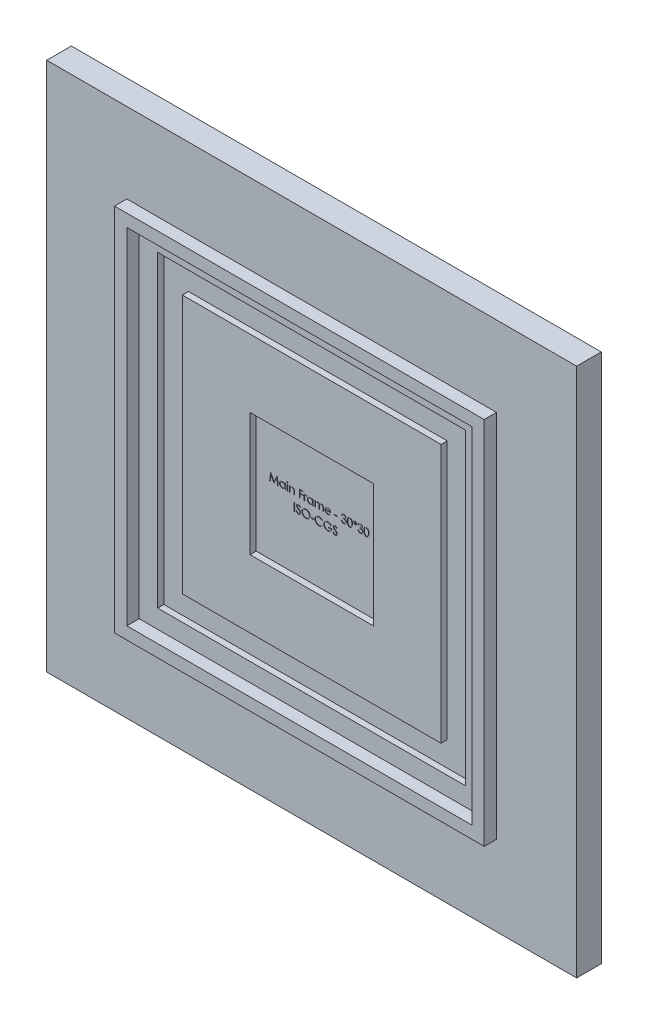
from build123d import *

# Parameters (mm, degrees)
SKETCH_2_W          = 430
SKETCH_2_H          = 430
EXTRUDE_1_DEPTH     = 20
SKETCH_3_W          = 300
SKETCH_3_H          = 300
SKETCH_3_W_2        = 280
SKETCH_3_H_2        = 280
EXTRUDE_2_DEPTH     = 10
SKETCH_6_W          = 250
SKETCH_6_H          = 250
SKETCH_6_W_2        = 210
SKETCH_6_H_2        = 210
SKETCH_6_W_3        = 100
SKETCH_6_H_3        = 100
CUT_EXTRUDE_2_DEPTH = 5
SKETCH_7_W          = 0.569871795
SKETCH_7_H          = 4.640384616
SKETCH_7_W_2        = 2.442307693
SKETCH_7_H_2        = 0.651282051
SKETCH_7_H_3        = 6.35
CUT_EXTRUDE_3_DEPTH = 0.4


with BuildPart() as part:
    # 스케치2 → 보스-돌출1 (new body)
    with BuildSketch(Plane.XY):
        Rectangle(SKETCH_2_W, SKETCH_2_H)
    extrude(amount=EXTRUDE_1_DEPTH)

    # 스케치3 → 보스-돌출2 (add)
    with BuildSketch(Plane.XY.offset(20)):
        Rectangle(SKETCH_3_W, SKETCH_3_H)
        Rectangle(SKETCH_3_W_2, SKETCH_3_H_2, mode=Mode.SUBTRACT)
    extrude(amount=EXTRUDE_2_DEPTH)

    # 스케치6 → 컷-돌출2 (cut)
    # profile 1 of 2: a face of its own
    with BuildSketch(Plane.XY.offset(20)):
        Rectangle(SKETCH_6_W, SKETCH_6_H)
        Rectangle(SKETCH_6_W_2, SKETCH_6_H_2, mode=Mode.SUBTRACT)
    # profile 2 of 2: a face of its own
    with BuildSketch(Plane.XY.offset(20)):
        Rectangle(SKETCH_6_W_3, SKETCH_6_H_3)
    extrude(amount=-CUT_EXTRUDE_2_DEPTH, mode=Mode.SUBTRACT)

    # 스케치7 → 컷-돌출3 (cut)
    # profile 1 of 23: a face of its own
    with BuildSketch(Plane.XY.offset(15)):
        Polygon((-39.106120256, 4.949322724), (-38.267849022, 11.299322724), (-38.186438765, 11.299322724), (-35.564774102, 6.089066314), (-32.949469615, 11.299322724), (-32.866787323, 11.299322724), (-32.023427948, 4.949322724), (-32.595843813, 4.949322724), (-33.203876666, 9.518473365), (-35.496084198, 4.949322724), (-35.624559759, 4.949322724), (-37.925671538, 9.528649647), (-38.532432355, 4.949322724), align=None)
    # profile 2 of 23: a face of its own
    with BuildSketch(Plane.XY.offset(15)):
        with BuildLine():
            Line((-26.161889486, 9.58970734), (-26.161889486, 4.949322724))
            Line((-26.161889486, 4.949322724), (-26.731761281, 4.949322724))
            Line((-26.731761281, 4.949322724), (-26.731761281, 5.751976971))
            add(Edge.make_bspline(
                [(-26.731761281, 5.751976971), (-26.796021087, 5.679333708), (-26.921424906, 5.537569466), (-27.130868077, 5.352363239), (-27.352878914, 5.199276855), (-27.586379883, 5.075633437), (-27.831160124, 4.98275642), (-28.086677026, 4.916741532), (-28.353034817, 4.874298431), (-28.534921232, 4.87006022), (-28.627093813, 4.867912468)],
                knots=[0, 0, 0, 0, 1.074387032, 2.096679803, 3.090159297, 4.057316773, 5.018401886, 5.985159533, 6.978961417, 8, 8, 8, 8], degree=3))
            add(Edge.make_bspline(
                [(-28.627093813, 4.867912468), (-28.709041387, 4.870137458), (-28.87064563, 4.874525236), (-29.108369813, 4.908565415), (-29.33713718, 4.963230972), (-29.557163904, 5.039251157), (-29.767026225, 5.140090647), (-29.968520972, 5.260815483), (-30.160604285, 5.404580989), (-30.340348363, 5.568933555), (-30.505869277, 5.747450175), (-30.651123301, 5.937851381), (-30.77223246, 6.139313847), (-30.873506035, 6.349286854), (-30.951513688, 6.56938678), (-31.005894425, 6.798852499), (-31.039894949, 7.037412698), (-31.044280914, 7.199862976), (-31.046504871, 7.282235385)],
                knots=[0, 0, 0, 0, 1.033919861, 2.038935746, 3.024066025, 3.998881131, 4.97069526, 5.957263378, 6.95902576, 7.993208707, 9.027059324, 10.027763471, 11.009749337, 11.988697705, 12.965288445, 13.950418724, 14.960734635, 16, 16, 16, 16], degree=3))
            add(Edge.make_bspline(
                [(-31.046504871, 7.282235385), (-31.044231623, 7.362905247), (-31.039737534, 7.522385212), (-31.006258121, 7.756933707), (-30.949959005, 7.982845409), (-30.870950767, 8.199393006), (-30.769637506, 8.406838526), (-30.646396548, 8.605328685), (-30.501218993, 8.795410306), (-30.333846769, 8.972613818), (-30.152536543, 9.136299789), (-29.95857356, 9.2785562), (-29.75678275, 9.401413912), (-29.544034145, 9.498756647), (-29.323476683, 9.577513166), (-29.09314686, 9.632001551), (-28.854002996, 9.664109548), (-28.691641675, 9.668759134), (-28.60928532, 9.671117596)],
                knots=[0, 0, 0, 0, 1.020392517, 2.01726096, 2.990465484, 3.961182959, 4.928053699, 5.906110375, 6.912531644, 7.948652711, 8.985773172, 9.998621852, 10.987621588, 11.969261332, 12.953316658, 13.946091881, 14.958173133, 16, 16, 16, 16], degree=3))
            add(Edge.make_bspline(
                [(-28.60928532, 9.671117596), (-28.514579861, 9.668509104), (-28.328866927, 9.663393974), (-28.057217538, 9.620825883), (-27.800233986, 9.548910378), (-27.555932518, 9.451088632), (-27.325190416, 9.321097366), (-27.110192145, 9.157122294), (-26.908687625, 8.960197569), (-26.791883382, 8.808939763), (-26.731761281, 8.731083542)],
                knots=[0, 0, 0, 0, 1.038897134, 2.037228247, 3.008116434, 3.962042015, 4.918381754, 5.904844433, 6.921570401, 8, 8, 8, 8], degree=3))
            Line((-26.731761281, 8.731083542), (-26.731761281, 9.58970734))
            Line((-26.731761281, 9.58970734), (-26.161889486, 9.58970734))
        make_face()
        with BuildLine():
            add(Edge.make_bspline(
                [(-28.601653108, 9.101245801), (-28.684954835, 9.098281916), (-28.849379195, 9.092431677), (-29.090759028, 9.046759764), (-29.321741936, 8.970769143), (-29.541172671, 8.866843408), (-29.745585007, 8.7361627), (-29.928272095, 8.578099619), (-30.090728139, 8.39696675), (-30.227358847, 8.193581493), (-30.338738749, 7.975544099), (-30.417056078, 7.747625476), (-30.468707427, 7.513936445), (-30.473984314, 7.355435572), (-30.476633076, 7.275875208)],
                knots=[0, 0, 0, 0, 1.031046209, 2.035121221, 3.029706178, 4.034933723, 5.034054252, 6.02443088, 7.017295772, 8.038157696, 9.050218397, 10.03989886, 11.016116709, 12, 12, 12, 12], degree=3))
            add(Edge.make_bspline(
                [(-30.476633076, 7.275875208), (-30.473249627, 7.196790299), (-30.46649599, 7.038930468), (-30.417962588, 6.80492285), (-30.336537674, 6.576950517), (-30.225427075, 6.356948429), (-30.086295627, 6.152688704), (-29.925026215, 5.968103053), (-29.740059276, 5.809371943), (-29.535176513, 5.676498059), (-29.316359195, 5.569160343), (-29.086246205, 5.494474111), (-28.849163262, 5.446254423), (-28.687959742, 5.440622015), (-28.606741249, 5.437784263)],
                knots=[0, 0, 0, 0, 0.979072187, 1.954306742, 2.945804271, 3.96968567, 4.997920485, 5.998718438, 6.996577872, 8.005894225, 9.015743152, 10.005417472, 10.995077863, 12, 12, 12, 12], degree=3))
            add(Edge.make_bspline(
                [(-28.606741249, 5.437784263), (-28.524288308, 5.440795912), (-28.360297587, 5.446785782), (-28.118201646, 5.492653221), (-27.883260785, 5.568433755), (-27.658675385, 5.673479314), (-27.449458975, 5.803667659), (-27.261684254, 5.956080524), (-27.102905283, 6.133342016), (-26.968298692, 6.32815358), (-26.862751864, 6.541716774), (-26.785869585, 6.769108806), (-26.740414642, 7.010337592), (-26.734685618, 7.175190716), (-26.731761281, 7.25933875)],
                knots=[0, 0, 0, 0, 1.01762866, 2.023962475, 3.030623092, 4.058876274, 5.077231937, 6.066672613, 7.034107872, 8.005628644, 8.981990164, 9.965428785, 10.961468474, 12, 12, 12, 12], degree=3))
            add(Edge.make_bspline(
                [(-26.731761281, 7.25933875), (-26.733502372, 7.323451671), (-26.73692939, 7.449646189), (-26.763110566, 7.634934685), (-26.804757361, 7.812251588), (-26.863442555, 7.981783324), (-26.940533886, 8.142592566), (-27.033511975, 8.295833959), (-27.144011862, 8.4407105), (-27.270254754, 8.575227214), (-27.408440193, 8.697920939), (-27.554661717, 8.807438918), (-27.710651729, 8.89740712), (-27.873786924, 8.971867713), (-28.044350346, 9.031120742), (-28.223729899, 9.070649844), (-28.410018918, 9.09779214), (-28.537102475, 9.10008246), (-28.601653108, 9.101245801)],
                knots=[0, 0, 0, 0, 1.050140795, 2.067009409, 3.05949893, 4.030605086, 5.00011959, 5.97591094, 6.962425594, 7.979863591, 8.993523472, 9.986985069, 10.967611495, 11.937549037, 12.921786183, 13.919465291, 14.943216303, 16, 16, 16, 16], degree=3))
        make_face(mode=Mode.SUBTRACT)
    # profile 3 of 23: a face of its own
    with BuildSketch(Plane.XY.offset(15)):
        with BuildLine():
            add(Edge.make_bspline(
                [(-24.658343813, 11.543553493), (-24.622980998, 11.541913103), (-24.553733812, 11.538700903), (-24.453597455, 11.511193651), (-24.362416876, 11.464567079), (-24.281540132, 11.402011087), (-24.212140281, 11.328442811), (-24.16355242, 11.242697911), (-24.132324216, 11.150062952), (-24.128553123, 11.085447005), (-24.126633076, 11.052547885)],
                knots=[0, 0, 0, 0, 1.055194115, 2.066272739, 3.074728998, 4.095836921, 5.109056067, 6.073838105, 7.019297344, 8, 8, 8, 8], degree=3))
            add(Edge.make_bspline(
                [(-24.126633076, 11.052547885), (-24.128596423, 11.020502785), (-24.132477728, 10.957153416), (-24.1635283, 10.866124403), (-24.21255436, 10.781570917), (-24.281495631, 10.708145486), (-24.362428668, 10.645624075), (-24.453594323, 10.598988334), (-24.553734636, 10.571483514), (-24.622981276, 10.568270978), (-24.658343813, 10.566630417)],
                knots=[0, 0, 0, 0, 0.96129708, 1.900370562, 2.859976407, 3.87933698, 4.906634145, 5.921202961, 6.938410037, 8, 8, 8, 8], degree=3))
            add(Edge.make_bspline(
                [(-24.658343813, 10.566630417), (-24.69330197, 10.568208338), (-24.761343454, 10.571279555), (-24.859980439, 10.599528015), (-24.950383556, 10.645640034), (-25.031418033, 10.707736112), (-25.098964241, 10.782021854), (-25.148128345, 10.866072802), (-25.179107205, 10.957166554), (-25.182998174, 11.020507198), (-25.184966409, 11.052547885)],
                knots=[0, 0, 0, 0, 1.054934014, 2.053291228, 3.073705704, 4.106921865, 5.123545215, 6.088680038, 7.033164197, 8, 8, 8, 8], degree=3))
            add(Edge.make_bspline(
                [(-25.184966409, 11.052547885), (-25.183041295, 11.085442426), (-25.179260249, 11.150049381), (-25.148105124, 11.242750369), (-25.099373759, 11.327988237), (-25.031373308, 11.402420214), (-24.950395458, 11.464551217), (-24.859977364, 11.510653998), (-24.761344266, 11.538904857), (-24.693302245, 11.541975743), (-24.658343813, 11.543553493)],
                knots=[0, 0, 0, 0, 0.98631895, 1.937192651, 2.907499808, 3.917963147, 4.944918757, 5.95915025, 6.951458133, 8, 8, 8, 8], degree=3))
        make_face()
    # profile 4 of 23: a face of its own
    with BuildSketch(Plane.XY.offset(15)):
        with Locations((-24.655799743, 7.269515032)):
            Rectangle(SKETCH_7_W, SKETCH_7_H)
    # profile 5 of 23: a face of its own
    with BuildSketch(Plane.XY.offset(15)):
        with BuildLine():
            Line((-22.986889486, 9.58970734), (-22.417017692, 9.58970734))
            Line((-22.417017692, 9.58970734), (-22.417017692, 8.752708141))
            add(Edge.make_bspline(
                [(-22.417017692, 8.752708141), (-22.356170839, 8.828622795), (-22.238095399, 8.97593783), (-22.041455252, 9.169559444), (-21.83363989, 9.32911721), (-21.615921969, 9.456305522), (-21.388005937, 9.5521844), (-21.151281075, 9.621428304), (-20.904330109, 9.662947921), (-20.736391773, 9.668373054), (-20.651432756, 9.671117596)],
                knots=[0, 0, 0, 0, 1.12780773, 2.188550248, 3.19190651, 4.159438251, 5.104880172, 6.052711206, 7.014878035, 8, 8, 8, 8], degree=3))
            add(Edge.make_bspline(
                [(-20.651432756, 9.671117596), (-20.565561462, 9.667951313), (-20.397490628, 9.661754133), (-20.152783288, 9.612738136), (-19.924231559, 9.529017459), (-19.712650365, 9.414332703), (-19.521919564, 9.271718101), (-19.354415905, 9.10556984), (-19.215871156, 8.914460089), (-19.122984512, 8.737162363), (-19.061796551, 8.579884122), (-19.023275024, 8.445179303), (-18.990561672, 8.295104943), (-18.962201215, 8.130114546), (-18.943011312, 7.949052115), (-18.927876012, 7.752659874), (-18.917028952, 7.541001437), (-18.916598591, 7.394612842), (-18.916376666, 7.319124407)],
                knots=[0, 0, 0, 0, 1.235846778, 2.418850247, 3.575807741, 4.728682307, 5.871620074, 6.994088408, 8.11269785, 9.256955736, 9.865816715, 10.540099792, 11.271859618, 12.076849838, 12.949306005, 13.892391288, 14.913166135, 16, 16, 16, 16], degree=3))
            Line((-18.916376666, 7.319124407), (-18.916376666, 4.949322724))
            Line((-18.916376666, 4.949322724), (-19.486248461, 4.949322724))
            Line((-19.486248461, 4.949322724), (-19.486248461, 7.132135224))
            add(Edge.make_bspline(
                [(-19.486248461, 7.132135224), (-19.486598995, 7.195313089), (-19.487269508, 7.316161591), (-19.489384324, 7.489188247), (-19.494482116, 7.646099611), (-19.501645484, 7.786520549), (-19.512130297, 7.910316224), (-19.523057071, 8.017738769), (-19.536419243, 8.108651796), (-19.548326242, 8.163379874), (-19.553666329, 8.187924487)],
                knots=[0, 0, 0, 0, 1.430800155, 2.736877192, 3.918605307, 4.986035426, 5.920637409, 6.731861385, 7.431261377, 8, 8, 8, 8], degree=3))
            add(Edge.make_bspline(
                [(-19.553666329, 8.187924487), (-19.572944079, 8.259971923), (-19.610047784, 8.398640945), (-19.701730867, 8.586735842), (-19.817508024, 8.746752554), (-19.958836979, 8.877701749), (-20.124352588, 8.979611696), (-20.313595547, 9.050321585), (-20.524739652, 9.094547102), (-20.673246889, 9.098950613), (-20.750651506, 9.101245801)],
                knots=[0, 0, 0, 0, 1.084156227, 2.086665306, 3.027808233, 3.945421172, 4.874247719, 5.839848303, 6.874090471, 8, 8, 8, 8], degree=3))
            add(Edge.make_bspline(
                [(-20.750651506, 9.101245801), (-20.796494303, 9.100382193), (-20.887216015, 9.098673134), (-21.021745249, 9.081525779), (-21.152236249, 9.053479724), (-21.279998628, 9.015618053), (-21.402477054, 8.963616507), (-21.523606554, 8.904598936), (-21.638825969, 8.831032894), (-21.750592132, 8.749044195), (-21.85457394, 8.658186205), (-21.951326783, 8.562311165), (-22.037574334, 8.460211141), (-22.115713216, 8.353531236), (-22.183165208, 8.24080633), (-22.242044382, 8.123123945), (-22.292002, 8.00032919), (-22.316826314, 7.915103007), (-22.329247259, 7.872459743)],
                knots=[0, 0, 0, 0, 1.023777757, 2.026029729, 3.023749952, 4.003683103, 4.997618607, 5.993177895, 7.010360494, 8.046726602, 9.087585522, 10.09234134, 11.086953743, 12.070360549, 13.043493632, 14.017870808, 15.008233677, 16, 16, 16, 16], degree=3))
            add(Edge.make_bspline(
                [(-22.329247259, 7.872459743), (-22.336394907, 7.841153875), (-22.351954963, 7.773002637), (-22.368761018, 7.661162048), (-22.384014762, 7.531785379), (-22.396781815, 7.385023604), (-22.404593071, 7.220362887), (-22.413110048, 7.038506439), (-22.416210773, 6.83872911), (-22.416741187, 6.699642896), (-22.417017692, 6.627137227)],
                knots=[0, 0, 0, 0, 0.615963638, 1.340920617, 2.168419149, 3.115676021, 4.16674242, 5.331190069, 6.6087489, 8, 8, 8, 8], degree=3))
            Line((-22.417017692, 6.627137227), (-22.417017692, 4.949322724))
            Line((-22.417017692, 4.949322724), (-22.986889486, 4.949322724))
            Line((-22.986889486, 4.949322724), (-22.986889486, 9.58970734))
        make_face()
    # profile 6 of 23: a face of its own
    with BuildSketch(Plane.XY.offset(15)):
        Polygon((-15.008684358, 11.299322724), (-11.915094615, 11.299322724), (-11.915094615, 10.648040673), (-14.438812563, 10.648040673), (-14.438812563, 8.694194519), (-11.915094615, 8.694194519), (-11.915094615, 8.042912468), (-14.438812563, 8.042912468), (-14.438812563, 4.949322724), (-15.008684358, 4.949322724), align=None)
    # profile 7 of 23: a face of its own
    with BuildSketch(Plane.XY.offset(15)):
        with BuildLine():
            Line((-11.10099205, 9.58970734), (-10.531120256, 9.58970734))
            Line((-10.531120256, 9.58970734), (-10.531120256, 8.906624407))
            add(Edge.make_bspline(
                [(-10.531120256, 8.906624407), (-10.489049222, 8.970225695), (-10.408588697, 9.091862666), (-10.274852382, 9.252734112), (-10.137867767, 9.385929982), (-9.99697907, 9.49207208), (-9.851150231, 9.571561596), (-9.703581762, 9.629787531), (-9.551951981, 9.664217803), (-9.450058204, 9.668814584), (-9.399008877, 9.671117596)],
                knots=[0, 0, 0, 0, 1.2804753, 2.448899062, 3.506932113, 4.484331642, 5.4025378, 6.288909075, 7.142734305, 8, 8, 8, 8], degree=3))
            add(Edge.make_bspline(
                [(-9.399008877, 9.671117596), (-9.359409685, 9.668957641), (-9.277931773, 9.664513392), (-9.154591932, 9.633288039), (-9.027513098, 9.583435055), (-8.945611909, 9.536553508), (-8.902915127, 9.512113189)],
                knots=[0, 0, 0, 0, 0.901110191, 1.854092781, 2.881294221, 4, 4, 4, 4], degree=3))
            Line((-8.902915127, 9.512113189), (-9.2158358, 9.01856351))
            add(Edge.make_bspline(
                [(-9.2158358, 9.01856351), (-9.243247882, 9.030792278), (-9.295281259, 9.054004822), (-9.37139883, 9.081476754), (-9.441577826, 9.097652773), (-9.486288282, 9.100103361), (-9.507131874, 9.101245801)],
                knots=[0, 0, 0, 0, 1.180555205, 2.24091978, 3.179933427, 4, 4, 4, 4], degree=3))
            add(Edge.make_bspline(
                [(-9.507131874, 9.101245801), (-9.552862276, 9.098197733), (-9.646139041, 9.091980559), (-9.78308949, 9.043105865), (-9.915980849, 8.964138643), (-10.021520865, 8.876561055), (-10.10324038, 8.792110051), (-10.161551932, 8.718362234), (-10.215042059, 8.635669574), (-10.266150888, 8.54544572), (-10.312716878, 8.446150142), (-10.356177493, 8.338774883), (-10.395472858, 8.223195578), (-10.41787973, 8.142673006), (-10.429357435, 8.10142609)],
                knots=[0, 0, 0, 0, 1.125678352, 2.296057538, 3.5422874, 4.923748041, 5.663163013, 6.437101912, 7.23742474, 8.08941207, 8.991984279, 9.93940061, 10.944477711, 12, 12, 12, 12], degree=3))
            add(Edge.make_bspline(
                [(-10.429357435, 8.10142609), (-10.437943349, 8.064637503), (-10.456960495, 7.98315358), (-10.475450857, 7.846449828), (-10.493719839, 7.684935476), (-10.506595133, 7.498160943), (-10.51852958, 7.286592652), (-10.52526073, 7.049908293), (-10.530890713, 6.787864928), (-10.53104142, 6.604668601), (-10.531120256, 6.508837949)],
                knots=[0, 0, 0, 0, 0.566838948, 1.255505196, 2.06880316, 3.007127437, 4.065329342, 5.249902469, 6.561414163, 8, 8, 8, 8], degree=3))
            Line((-10.531120256, 6.508837949), (-10.531120256, 4.949322724))
            Line((-10.531120256, 4.949322724), (-11.10099205, 4.949322724))
            Line((-11.10099205, 4.949322724), (-11.10099205, 9.58970734))
        make_face()
    # profile 8 of 23: a face of its own
    with BuildSketch(Plane.XY.offset(15)):
        with BuildLine():
            Line((-3.611248461, 9.58970734), (-3.611248461, 4.949322724))
            Line((-3.611248461, 4.949322724), (-4.181120256, 4.949322724))
            Line((-4.181120256, 4.949322724), (-4.181120256, 5.751976971))
            add(Edge.make_bspline(
                [(-4.181120256, 5.751976971), (-4.245380061, 5.679333708), (-4.370783881, 5.537569466), (-4.580227052, 5.352363239), (-4.802237889, 5.199276855), (-5.035738857, 5.075633437), (-5.280519099, 4.98275642), (-5.536036, 4.916741532), (-5.802393791, 4.874298431), (-5.984280206, 4.87006022), (-6.076452788, 4.867912468)],
                knots=[0, 0, 0, 0, 1.074387032, 2.096679803, 3.090159297, 4.057316773, 5.018401886, 5.985159533, 6.978961417, 8, 8, 8, 8], degree=3))
            add(Edge.make_bspline(
                [(-6.076452788, 4.867912468), (-6.158400361, 4.870137458), (-6.320004604, 4.874525236), (-6.557728787, 4.908565415), (-6.786496154, 4.963230972), (-7.006522879, 5.039251157), (-7.2163852, 5.140090647), (-7.417879946, 5.260815483), (-7.609963259, 5.404580989), (-7.789707337, 5.568933555), (-7.955228252, 5.747450175), (-8.100482275, 5.937851381), (-8.221591434, 6.139313847), (-8.322865009, 6.349286854), (-8.400872663, 6.56938678), (-8.455253399, 6.798852499), (-8.489253924, 7.037412698), (-8.493639888, 7.199862976), (-8.495863845, 7.282235385)],
                knots=[0, 0, 0, 0, 1.033919861, 2.038935746, 3.024066025, 3.998881131, 4.97069526, 5.957263378, 6.95902576, 7.993208707, 9.027059324, 10.027763471, 11.009749337, 11.988697705, 12.965288445, 13.950418724, 14.960734635, 16, 16, 16, 16], degree=3))
            add(Edge.make_bspline(
                [(-8.495863845, 7.282235385), (-8.493590597, 7.362905247), (-8.489096508, 7.522385212), (-8.455617095, 7.756933707), (-8.39931798, 7.982845409), (-8.320309742, 8.199393006), (-8.218996481, 8.406838526), (-8.095755523, 8.605328685), (-7.950577968, 8.795410306), (-7.783205744, 8.972613818), (-7.601895518, 9.136299789), (-7.407932535, 9.2785562), (-7.206141724, 9.401413912), (-6.993393119, 9.498756647), (-6.772835658, 9.577513166), (-6.542505835, 9.632001551), (-6.303361971, 9.664109548), (-6.141000649, 9.668759134), (-6.058644294, 9.671117596)],
                knots=[0, 0, 0, 0, 1.020392517, 2.01726096, 2.990465484, 3.961182959, 4.928053699, 5.906110375, 6.912531644, 7.948652711, 8.985773172, 9.998621852, 10.987621588, 11.969261332, 12.953316658, 13.946091881, 14.958173133, 16, 16, 16, 16], degree=3))
            add(Edge.make_bspline(
                [(-6.058644294, 9.671117596), (-5.963938835, 9.668509104), (-5.778225901, 9.663393974), (-5.506576513, 9.620825883), (-5.24959296, 9.548910378), (-5.005291493, 9.451088632), (-4.774549391, 9.321097366), (-4.559551119, 9.157122294), (-4.3580466, 8.960197569), (-4.241242356, 8.808939763), (-4.181120256, 8.731083542)],
                knots=[0, 0, 0, 0, 1.038897134, 2.037228247, 3.008116434, 3.962042015, 4.918381754, 5.904844433, 6.921570401, 8, 8, 8, 8], degree=3))
            Line((-4.181120256, 8.731083542), (-4.181120256, 9.58970734))
            Line((-4.181120256, 9.58970734), (-3.611248461, 9.58970734))
        make_face()
        with BuildLine():
            add(Edge.make_bspline(
                [(-6.051012083, 9.101245801), (-6.13431381, 9.098281916), (-6.29873817, 9.092431677), (-6.540118002, 9.046759764), (-6.77110091, 8.970769143), (-6.990531645, 8.866843408), (-7.194943981, 8.7361627), (-7.37763107, 8.578099619), (-7.540087113, 8.39696675), (-7.676717821, 8.193581493), (-7.788097723, 7.975544099), (-7.866415052, 7.747625476), (-7.918066401, 7.513936445), (-7.923343289, 7.355435572), (-7.92599205, 7.275875208)],
                knots=[0, 0, 0, 0, 1.031046209, 2.035121221, 3.029706178, 4.034933723, 5.034054252, 6.02443088, 7.017295772, 8.038157696, 9.050218397, 10.03989886, 11.016116709, 12, 12, 12, 12], degree=3))
            add(Edge.make_bspline(
                [(-7.92599205, 7.275875208), (-7.922608601, 7.196790299), (-7.915854965, 7.038930468), (-7.867321562, 6.80492285), (-7.785896649, 6.576950517), (-7.674786049, 6.356948429), (-7.535654601, 6.152688704), (-7.374385189, 5.968103053), (-7.18941825, 5.809371943), (-6.984535487, 5.676498059), (-6.765718169, 5.569160343), (-6.535605179, 5.494474111), (-6.298522236, 5.446254423), (-6.137318716, 5.440622015), (-6.056100224, 5.437784263)],
                knots=[0, 0, 0, 0, 0.979072187, 1.954306742, 2.945804271, 3.96968567, 4.997920485, 5.998718438, 6.996577872, 8.005894225, 9.015743152, 10.005417472, 10.995077863, 12, 12, 12, 12], degree=3))
            add(Edge.make_bspline(
                [(-6.056100224, 5.437784263), (-5.973647283, 5.440795912), (-5.809656562, 5.446785782), (-5.56756062, 5.492653221), (-5.332619759, 5.568433755), (-5.108034359, 5.673479314), (-4.89881795, 5.803667659), (-4.711043229, 5.956080524), (-4.552264258, 6.133342016), (-4.417657666, 6.32815358), (-4.312110839, 6.541716774), (-4.23522856, 6.769108806), (-4.189773616, 7.010337592), (-4.184044593, 7.175190716), (-4.181120256, 7.25933875)],
                knots=[0, 0, 0, 0, 1.01762866, 2.023962475, 3.030623092, 4.058876274, 5.077231937, 6.066672613, 7.034107872, 8.005628644, 8.981990164, 9.965428785, 10.961468474, 12, 12, 12, 12], degree=3))
            add(Edge.make_bspline(
                [(-4.181120256, 7.25933875), (-4.182861346, 7.323451671), (-4.186288364, 7.449646189), (-4.21246954, 7.634934685), (-4.254116335, 7.812251588), (-4.31280153, 7.981783324), (-4.38989286, 8.142592566), (-4.482870949, 8.295833959), (-4.593370837, 8.4407105), (-4.719613728, 8.575227214), (-4.857799167, 8.697920939), (-5.004020691, 8.807438918), (-5.160010703, 8.89740712), (-5.323145899, 8.971867713), (-5.49370932, 9.031120742), (-5.673088873, 9.070649844), (-5.859377892, 9.09779214), (-5.98646145, 9.10008246), (-6.051012083, 9.101245801)],
                knots=[0, 0, 0, 0, 1.050140795, 2.067009409, 3.05949893, 4.030605086, 5.00011959, 5.97591094, 6.962425594, 7.979863591, 8.993523472, 9.986985069, 10.967611495, 11.937549037, 12.921786183, 13.919465291, 14.943216303, 16, 16, 16, 16], degree=3))
        make_face(mode=Mode.SUBTRACT)
    # profile 9 of 23: a face of its own
    with BuildSketch(Plane.XY.offset(15)):
        with BuildLine():
            Line((-2.308684358, 9.58970734), (-1.738812563, 9.58970734))
            Line((-1.738812563, 9.58970734), (-1.738812563, 8.783236987))
            add(Edge.make_bspline(
                [(-1.738812563, 8.783236987), (-1.687497397, 8.853790207), (-1.589172619, 8.988976941), (-1.427944935, 9.167122171), (-1.266879702, 9.318303252), (-1.150886281, 9.397665319), (-1.095162724, 9.435791074)],
                knots=[0, 0, 0, 0, 1.134379233, 2.173579362, 3.122582517, 4, 4, 4, 4], degree=3))
            add(Edge.make_bspline(
                [(-1.095162724, 9.435791074), (-1.019208265, 9.472086522), (-0.868626361, 9.544043295), (-0.630194339, 9.617038466), (-0.386218867, 9.661896864), (-0.221466822, 9.668031642), (-0.138592211, 9.671117596)],
                knots=[0, 0, 0, 0, 1.014936303, 2.012140481, 3.000054389, 4, 4, 4, 4], degree=3))
            add(Edge.make_bspline(
                [(-0.138592211, 9.671117596), (-0.082543488, 9.66922114), (0.028373919, 9.665468155), (0.19271934, 9.641047806), (0.352119964, 9.59883632), (0.505633989, 9.540040175), (0.650270078, 9.468835472), (0.782874766, 9.385288145), (0.901935829, 9.291494879), (1.007393094, 9.183220244), (1.10222404, 9.057423844), (1.189452804, 8.910712992), (1.270052833, 8.739793378), (1.314722921, 8.61575694), (1.338240722, 8.550454535)],
                knots=[0, 0, 0, 0, 1.009824226, 1.998387844, 2.986035974, 3.974953746, 4.955485308, 5.885931332, 6.793869504, 7.679848016, 8.601185859, 9.625726857, 10.749998409, 12, 12, 12, 12], degree=3))
            add(Edge.make_bspline(
                [(1.338240722, 8.550454535), (1.363116849, 8.595311696), (1.412069575, 8.683584289), (1.494266945, 8.80851285), (1.58038709, 8.925365172), (1.671163956, 9.034233971), (1.766277135, 9.134581625), (1.866174247, 9.226739903), (1.970286636, 9.311104577), (2.115052557, 9.409662309), (2.303398288, 9.514348738), (2.540866724, 9.605114629), (2.787882036, 9.661205319), (2.955554145, 9.667791671), (3.040223895, 9.671117596)],
                knots=[0, 0, 0, 0, 0.86119277, 1.694706429, 2.50939023, 3.298075842, 4.073795165, 4.829715201, 5.57930267, 6.321991688, 7.768977793, 9.186738141, 10.579381044, 12, 12, 12, 12], degree=3))
            add(Edge.make_bspline(
                [(3.040223895, 9.671117596), (3.11802312, 9.668183495), (3.270283758, 9.662441175), (3.491948226, 9.617349874), (3.698671216, 9.539920428), (3.890036768, 9.434267973), (4.062683858, 9.301500027), (4.212754876, 9.143532278), (4.33933825, 8.961482091), (4.422030925, 8.790228054), (4.478120047, 8.63903395), (4.512702572, 8.51020825), (4.54325459, 8.368419004), (4.568620564, 8.213496673), (4.587159937, 8.044893998), (4.600895378, 7.862886894), (4.610191911, 7.667333906), (4.610848814, 7.532413641), (4.611187437, 7.462864391)],
                knots=[0, 0, 0, 0, 1.209669288, 2.367440248, 3.500751976, 4.631527125, 5.755587489, 6.87532382, 8.007944318, 9.190864318, 9.82315674, 10.514484317, 11.263564316, 12.079023757, 12.955305781, 13.901327259, 14.918167583, 16, 16, 16, 16], degree=3))
            Line((4.611187437, 7.462864391), (4.611187437, 4.949322724))
            Line((4.611187437, 4.949322724), (4.041315642, 4.949322724))
            Line((4.041315642, 4.949322724), (4.041315642, 7.465408461))
            add(Edge.make_bspline(
                [(4.041315642, 7.465408461), (4.04117434, 7.524772931), (4.040902779, 7.638862414), (4.036015762, 7.802606147), (4.026807692, 7.951864452), (4.016040562, 8.086433812), (4.001083936, 8.206628043), (3.981769174, 8.312205716), (3.961308241, 8.403997346), (3.9273158, 8.50575346), (3.872981768, 8.618003699), (3.790218625, 8.73905933), (3.685951433, 8.844434496), (3.565555148, 8.935907728), (3.428488685, 9.010281905), (3.277422687, 9.063396951), (3.11329505, 9.096277031), (2.99967942, 9.099553659), (2.941005145, 9.101245801)],
                knots=[0, 0, 0, 0, 1.253487763, 2.409012846, 3.458416907, 4.410876679, 5.259312806, 6.014470957, 6.676830364, 7.243083969, 8.276244668, 9.299465089, 10.325150304, 11.392391894, 12.482080715, 13.603491619, 14.762376348, 16, 16, 16, 16], degree=3))
            add(Edge.make_bspline(
                [(2.941005145, 9.101245801), (2.869032514, 9.098676487), (2.726787232, 9.093598546), (2.519150421, 9.041757376), (2.319631577, 8.963597493), (2.134184121, 8.850327178), (1.963590844, 8.714603432), (1.816815896, 8.553223451), (1.695563216, 8.370652012), (1.613459574, 8.201657281), (1.561590413, 8.049857004), (1.527342295, 7.917237486), (1.500702427, 7.766503785), (1.475718753, 7.598668765), (1.459412446, 7.412577153), (1.444592685, 7.209089768), (1.437660548, 6.987594584), (1.436690887, 6.834057592), (1.436187437, 6.754340753)],
                knots=[0, 0, 0, 0, 1.090531906, 2.155305635, 3.229839962, 4.33261226, 5.44038871, 6.529323825, 7.629011124, 8.757537029, 9.370236727, 10.061839251, 10.834451254, 11.692844982, 12.636905849, 13.66920014, 14.789842145, 16, 16, 16, 16], degree=3))
            Line((1.436187437, 6.754340753), (1.436187437, 4.949322724))
            Line((1.436187437, 4.949322724), (0.866315642, 4.949322724))
            Line((0.866315642, 4.949322724), (0.866315642, 7.308948125))
            add(Edge.make_bspline(
                [(0.866315642, 7.308948125), (0.866171531, 7.375520289), (0.865894277, 7.503598441), (0.861038673, 7.687265252), (0.851810088, 7.85432664), (0.841141093, 8.004588439), (0.825791912, 8.137777564), (0.808357058, 8.254608054), (0.787767436, 8.354787016), (0.753677217, 8.4646663), (0.701580967, 8.585717118), (0.617782263, 8.714787256), (0.513265653, 8.827759376), (0.390672778, 8.924204534), (0.252776755, 9.003926936), (0.100406871, 9.061366771), (-0.0650649, 9.094793696), (-0.179143023, 9.09905454), (-0.237810961, 9.101245801)],
                knots=[0, 0, 0, 0, 1.320475261, 2.540461679, 3.643808994, 4.639130445, 5.527981419, 6.302341397, 6.981980563, 7.553956391, 8.582137848, 9.585246428, 10.591171744, 11.620968678, 12.668337649, 13.738356861, 14.836885341, 16, 16, 16, 16], degree=3))
            add(Edge.make_bspline(
                [(-0.237810961, 9.101245801), (-0.30678323, 9.098469109), (-0.444242514, 9.092935261), (-0.646176087, 9.043125365), (-0.841185827, 8.965103686), (-1.026160781, 8.856863729), (-1.19611245, 8.722789686), (-1.344898878, 8.565101232), (-1.469980317, 8.385760843), (-1.552950895, 8.218548077), (-1.606469556, 8.07055085), (-1.642021091, 7.944728416), (-1.672572984, 7.805027966), (-1.695276995, 7.651018493), (-1.71719432, 7.483703079), (-1.727772167, 7.302248219), (-1.738062001, 7.106809574), (-1.738556239, 6.971876528), (-1.738812563, 6.901896843)],
                knots=[0, 0, 0, 0, 1.098833095, 2.189935336, 3.297829714, 4.440610912, 5.596351641, 6.740013378, 7.886572111, 9.072425424, 9.705826452, 10.395263256, 11.156850408, 11.985370555, 12.878090359, 13.847760091, 14.883794034, 16, 16, 16, 16], degree=3))
            Line((-1.738812563, 6.901896843), (-1.738812563, 4.949322724))
            Line((-1.738812563, 4.949322724), (-2.308684358, 4.949322724))
            Line((-2.308684358, 4.949322724), (-2.308684358, 9.58970734))
        make_face()
    # profile 10 of 23: a face of its own
    with BuildSketch(Plane.XY.offset(15)):
        with BuildLine():
            Line((9.722225097, 6.41470734), (10.228495129, 6.148851971))
            add(Edge.make_bspline(
                [(10.228495129, 6.148851971), (10.188151592, 6.077290499), (10.109659045, 5.938060212), (9.974674831, 5.746776694), (9.833174928, 5.574695838), (9.678772015, 5.426414894), (9.516085597, 5.297144524), (9.344213495, 5.184045899), (9.162260925, 5.087673726), (8.970219282, 5.006479854), (8.766475811, 4.944051201), (8.550536774, 4.8999564), (8.321988489, 4.872699898), (8.165331849, 4.869533714), (8.085115722, 4.867912468)],
                knots=[0, 0, 0, 0, 1.120438281, 2.179929193, 3.190490725, 4.156257408, 5.095198341, 6.022838206, 6.959905092, 7.901321166, 8.864066838, 9.862729781, 10.905609505, 12, 12, 12, 12], degree=3))
            add(Edge.make_bspline(
                [(8.085115722, 4.867912468), (7.995958134, 4.869993772), (7.822037509, 4.874053792), (7.56887254, 4.909055835), (7.330512738, 4.966155686), (7.106971504, 5.04592174), (6.898796275, 5.150111313), (6.705573295, 5.277037802), (6.526286441, 5.426049178), (6.366585376, 5.598436154), (6.222814332, 5.782916277), (6.095948915, 5.975150524), (5.989890433, 6.174655232), (5.903616412, 6.380160325), (5.833939014, 6.590370532), (5.785376566, 6.80719848), (5.757382595, 7.030057326), (5.753092815, 7.180819635), (5.750931026, 7.256794679)],
                knots=[0, 0, 0, 0, 1.145258523, 2.234067595, 3.276747158, 4.290159414, 5.277019952, 6.260822364, 7.254936242, 8.264827045, 9.274100331, 10.257902744, 11.220704747, 12.172965371, 13.118907548, 14.062713208, 15.023725156, 16, 16, 16, 16], degree=3))
            add(Edge.make_bspline(
                [(5.750931026, 7.256794679), (5.752852611, 7.328086729), (5.756660939, 7.469378156), (5.780665368, 7.678502787), (5.823207271, 7.881754408), (5.881584316, 8.079301906), (5.956970148, 8.270814521), (6.049194317, 8.456408808), (6.158400488, 8.635887276), (6.242715196, 8.74910439), (6.285185834, 8.806133622)],
                knots=[0, 0, 0, 0, 1.024358464, 2.0301432, 3.019427413, 4.004406732, 4.986367066, 5.972626655, 6.978780325, 8, 8, 8, 8], degree=3))
            add(Edge.make_bspline(
                [(6.285185834, 8.806133622), (6.34271263, 8.874838572), (6.455943919, 9.010072073), (6.647453306, 9.187760179), (6.85482652, 9.336611028), (7.075464756, 9.459995403), (7.311932359, 9.553746163), (7.561050644, 9.623609919), (7.825656207, 9.662758596), (8.006549965, 9.668288237), (8.09910811, 9.671117596)],
                knots=[0, 0, 0, 0, 1.030682036, 2.02871468, 2.997146059, 3.962720338, 4.930598197, 5.918074684, 6.934738563, 8, 8, 8, 8], degree=3))
            add(Edge.make_bspline(
                [(8.09910811, 9.671117596), (8.194263051, 9.668660964), (8.380935354, 9.663841613), (8.653136488, 9.619162408), (8.910693788, 9.548309917), (9.153504189, 9.448245182), (9.381592308, 9.319141424), (9.593475569, 9.15922694), (9.792777599, 8.973411268), (9.90872602, 8.830512302), (9.967727901, 8.757796282)],
                knots=[0, 0, 0, 0, 1.056321875, 2.072262726, 3.055038591, 4.01806755, 4.982017516, 5.957941055, 6.960871419, 8, 8, 8, 8], degree=3))
            add(Edge.make_bspline(
                [(9.967727901, 8.757796282), (10.00787249, 8.702998356), (10.087894451, 8.593767255), (10.188128476, 8.415656727), (10.275136892, 8.229310363), (10.344683836, 8.031715967), (10.400998359, 7.825214728), (10.441741445, 7.608330397), (10.465634896, 7.381127558), (10.470331532, 7.226320807), (10.472725898, 7.147399647)],
                knots=[0, 0, 0, 0, 0.94817472, 1.890038105, 2.849395472, 3.817997239, 4.812318967, 5.836947057, 6.897266129, 8, 8, 8, 8], degree=3))
            Line((10.472725898, 7.147399647), (6.320802821, 7.147399647))
            add(Edge.make_bspline(
                [(6.320802821, 7.147399647), (6.323596107, 7.086257376), (6.329088991, 6.966023567), (6.354697894, 6.79009086), (6.395063526, 6.622499225), (6.45179454, 6.464505706), (6.520495816, 6.314046761), (6.60465276, 6.172238494), (6.705054522, 6.039726821), (6.817042577, 5.915326442), (6.941696878, 5.804544776), (7.072838434, 5.705390839), (7.21234533, 5.622286399), (7.359117567, 5.554831456), (7.512917806, 5.502024283), (7.673794503, 5.465978379), (7.841431086, 5.441835486), (7.955705203, 5.43915095), (8.013881748, 5.437784263)],
                knots=[0, 0, 0, 0, 1.094153842, 2.151609401, 3.174256925, 4.172055639, 5.149267565, 6.128595816, 7.11444997, 8.118368179, 9.117203808, 10.09244225, 11.054858984, 12.015122123, 12.976791628, 13.957293641, 14.960065497, 16, 16, 16, 16], degree=3))
            add(Edge.make_bspline(
                [(8.013881748, 5.437784263), (8.070761687, 5.438887451), (8.183622398, 5.441076389), (8.351699382, 5.462361427), (8.517052524, 5.496778927), (8.678997451, 5.543750766), (8.834247414, 5.601040198), (8.978021484, 5.670169668), (9.110247018, 5.746641352), (9.233830657, 5.834107477), (9.353702316, 5.941165187), (9.472615113, 6.074761424), (9.600117041, 6.232763081), (9.679926731, 6.351681647), (9.722225097, 6.41470734)],
                knots=[0, 0, 0, 0, 0.99110716, 1.966546729, 2.947904876, 3.932708344, 4.903319531, 5.828989031, 6.710028674, 7.56322171, 8.463672341, 9.504779593, 10.677557249, 12, 12, 12, 12], degree=3))
        make_face()
        with BuildLine():
            add(Edge.make_bspline(
                [(9.902854103, 7.717271442), (9.881995942, 7.792859799), (9.841850695, 7.938343053), (9.757964719, 8.139802955), (9.663492067, 8.318851004), (9.55169264, 8.474116909), (9.425021523, 8.612008997), (9.278708121, 8.732511287), (9.114631571, 8.84031152), (8.933639987, 8.931302483), (8.741975606, 9.008754084), (8.541304372, 9.060688223), (8.336548099, 9.096265535), (8.198055894, 9.099578618), (8.128364921, 9.101245801)],
                knots=[0, 0, 0, 0, 1.154881502, 2.222775134, 3.210006277, 4.132804581, 5.035138423, 5.962687519, 6.919655026, 7.923214229, 8.944639381, 9.960483929, 10.97369054, 12, 12, 12, 12], degree=3))
            add(Edge.make_bspline(
                [(8.128364921, 9.101245801), (8.071488082, 9.100136054), (7.95905453, 9.097942318), (7.793408307, 9.077132226), (7.634332281, 9.04273365), (7.480652688, 8.995625801), (7.334383398, 8.932835907), (7.192515748, 8.859206339), (7.058657029, 8.769323751), (6.974943535, 8.7008184), (6.93265178, 8.666209743)],
                knots=[0, 0, 0, 0, 1.04873581, 2.073130211, 3.073294108, 4.04793562, 5.032784715, 6.005352987, 6.992311501, 8, 8, 8, 8], degree=3))
            add(Edge.make_bspline(
                [(6.93265178, 8.666209743), (6.902365397, 8.638824342), (6.841073139, 8.583402965), (6.759175336, 8.487918547), (6.680761049, 8.384954998), (6.609398565, 8.27057313), (6.543943515, 8.146075431), (6.482693271, 8.012512007), (6.427563638, 7.868869327), (6.39654641, 7.768770759), (6.380588478, 7.717271442)],
                knots=[0, 0, 0, 0, 0.879870761, 1.780643979, 2.707998968, 3.669668524, 4.684282772, 5.740141944, 6.837334558, 8, 8, 8, 8], degree=3))
            Line((6.380588478, 7.717271442), (9.902854103, 7.717271442))
        make_face(mode=Mode.SUBTRACT)
    # profile 11 of 23: a face of its own
    with BuildSketch(Plane.XY.offset(15)):
        with Locations((14.868879745, 7.391630416)):
            Rectangle(SKETCH_7_W_2, SKETCH_7_H_2)
    # profile 12 of 23: a face of its own
    with BuildSketch(Plane.XY.offset(15)):
        with BuildLine():
            Line((19.834905385, 9.833938109), (19.265033591, 9.833938109))
            add(Edge.make_bspline(
                [(19.265033591, 9.833938109), (19.280472347, 9.897859901), (19.310653852, 10.022821777), (19.373605164, 10.201360664), (19.442183813, 10.370313339), (19.524532617, 10.526516216), (19.614355643, 10.67310851), (19.717266866, 10.806765351), (19.828518363, 10.930886017), (19.951572199, 11.041037176), (20.080619914, 11.140782485), (20.217479867, 11.225827232), (20.359398545, 11.298986766), (20.507359229, 11.359257758), (20.661802427, 11.404661208), (20.821331886, 11.437602841), (20.986365665, 11.458995291), (21.098393436, 11.461083104), (21.155277982, 11.462143237)],
                knots=[0, 0, 0, 0, 1.162005537, 2.271625781, 3.343758855, 4.383309926, 5.390229558, 6.379919256, 7.361854164, 8.333198761, 9.295911338, 10.242430842, 11.177959212, 12.116337295, 13.062827104, 14.020064771, 14.994644689, 16, 16, 16, 16], degree=3))
            add(Edge.make_bspline(
                [(21.155277982, 11.462143237), (21.238159528, 11.459640919), (21.402114733, 11.454690867), (21.642984833, 11.409488961), (21.875262062, 11.337960506), (22.096403983, 11.239129601), (22.301814568, 11.117232619), (22.484578792, 10.972153739), (22.642219376, 10.806692149), (22.774470604, 10.623934497), (22.87802096, 10.428616644), (22.954377666, 10.227593502), (23.000862716, 10.021341925), (23.006887154, 9.88208229), (23.009905385, 9.81231351)],
                knots=[0, 0, 0, 0, 1.083050992, 2.142477498, 3.193116406, 4.255571735, 5.30263384, 6.308962982, 7.297363603, 8.282367274, 9.249857812, 10.179914175, 11.08814088, 12, 12, 12, 12], degree=3))
            add(Edge.make_bspline(
                [(23.009905385, 9.81231351), (23.007794299, 9.745172611), (23.00366323, 9.61378829), (22.968586364, 9.421979288), (22.909556287, 9.241200956), (22.827786861, 9.070692277), (22.72193862, 8.911534353), (22.593718155, 8.763369094), (22.442220469, 8.625539335), (22.327414396, 8.546582577), (22.268308831, 8.505933301)],
                knots=[0, 0, 0, 0, 1.024540389, 2.004866551, 2.965041327, 3.920577974, 4.882998113, 5.874504559, 6.905732034, 8, 8, 8, 8], degree=3))
            add(Edge.make_bspline(
                [(22.268308831, 8.505933301), (22.335857871, 8.473315761), (22.469692058, 8.408690981), (22.652119447, 8.281952678), (22.817723592, 8.135619019), (22.910077482, 8.021423063), (22.956479905, 7.964046282)],
                knots=[0, 0, 0, 0, 1.015518401, 2.012035669, 3.001164323, 4, 4, 4, 4], degree=3))
            add(Edge.make_bspline(
                [(22.956479905, 7.964046282), (22.987034911, 7.922212933), (23.047644566, 7.839231284), (23.122457606, 7.705815197), (23.190328427, 7.570920352), (23.243215254, 7.430931144), (23.284170698, 7.287470105), (23.313446071, 7.140290901), (23.331632726, 6.989273346), (23.334237228, 6.887106417), (23.335546411, 6.83575101)],
                knots=[0, 0, 0, 0, 1.025084078, 2.033381695, 3.024893161, 4.013698104, 4.991890475, 5.976764909, 6.982997093, 8, 8, 8, 8], degree=3))
            add(Edge.make_bspline(
                [(23.335546411, 6.83575101), (23.332290651, 6.746833373), (23.325794452, 6.569416546), (23.267729917, 6.307298123), (23.177717323, 6.051074711), (23.049888311, 5.80601036), (22.894100116, 5.57672024), (22.708757542, 5.371567508), (22.495966487, 5.195221469), (22.258647667, 5.047882912), (22.001532306, 4.930103254), (21.726530874, 4.848356179), (21.437605776, 4.795114151), (21.239472537, 4.789404831), (21.138741523, 4.786502211)],
                knots=[0, 0, 0, 0, 0.955779014, 1.907060117, 2.875433937, 3.871313158, 4.872415639, 5.851225146, 6.836215519, 7.83643374, 8.849228613, 9.86973379, 10.916971861, 12, 12, 12, 12], degree=3))
            add(Edge.make_bspline(
                [(21.138741523, 4.786502211), (21.070852221, 4.788077398), (20.937268714, 4.791176841), (20.740884081, 4.81236516), (20.553428998, 4.851063884), (20.374650013, 4.903139881), (20.204388304, 4.969164899), (20.043163428, 5.051385965), (19.889983478, 5.148108262), (19.746293952, 5.260473485), (19.612111979, 5.38616963), (19.491003465, 5.52742812), (19.38094927, 5.681637695), (19.284896197, 5.850589526), (19.198469154, 6.032100207), (19.127383704, 6.228493911), (19.064817029, 6.438014923), (19.035727744, 6.584024537), (19.020802821, 6.658938109)],
                knots=[0, 0, 0, 0, 1.048658725, 2.063410685, 3.046034179, 4.001477787, 4.936774919, 5.862367409, 6.792675028, 7.730719943, 8.675894397, 9.627829632, 10.600096036, 11.597688215, 12.626045268, 13.701542398, 14.82072376, 16, 16, 16, 16], degree=3))
            Line((19.020802821, 6.658938109), (19.590674616, 6.658938109))
            add(Edge.make_bspline(
                [(19.590674616, 6.658938109), (19.605521445, 6.610044899), (19.634399816, 6.514943359), (19.683556614, 6.37807309), (19.739560479, 6.252600622), (19.79963975, 6.13760553), (19.862737788, 6.031955314), (19.933340581, 5.938443637), (20.006218887, 5.852963199), (20.061154285, 5.804803688), (20.088040401, 5.781233782)],
                knots=[0, 0, 0, 0, 1.198163088, 2.33053128, 3.407730985, 4.417276592, 5.372219308, 6.28897303, 7.162600585, 8, 8, 8, 8], degree=3))
            add(Edge.make_bspline(
                [(20.088040401, 5.781233782), (20.12359419, 5.753822948), (20.194592022, 5.69908589), (20.310285812, 5.629232935), (20.431960677, 5.568706504), (20.562253014, 5.522471799), (20.698351241, 5.483323757), (20.842455175, 5.457705101), (20.993293469, 5.44012799), (21.096286411, 5.4385769), (21.148917805, 5.437784263)],
                knots=[0, 0, 0, 0, 0.946170439, 1.889420265, 2.845303464, 3.807233317, 4.801018734, 5.828864929, 6.890507805, 8, 8, 8, 8], degree=3))
            add(Edge.make_bspline(
                [(21.148917805, 5.437784263), (21.208342017, 5.438901691), (21.324540934, 5.441086725), (21.49409475, 5.461181222), (21.655398262, 5.4904464), (21.80666057, 5.535645669), (21.949863062, 5.591490928), (22.082998341, 5.661610178), (22.207814133, 5.743878459), (22.322711769, 5.837385218), (22.42602719, 5.939749931), (22.516994592, 6.046816502), (22.594327907, 6.158133507), (22.656709541, 6.274316955), (22.705968397, 6.394885728), (22.739502204, 6.520178175), (22.762818524, 6.64916893), (22.764717378, 6.736851488), (22.765674616, 6.781053493)],
                knots=[0, 0, 0, 0, 1.217147791, 2.380027433, 3.494444702, 4.572153297, 5.609568379, 6.639424714, 7.649109417, 8.668170816, 9.669597737, 10.625200337, 11.543417969, 12.441394052, 13.322311151, 14.205496177, 15.095365482, 16, 16, 16, 16], degree=3))
            add(Edge.make_bspline(
                [(22.765674616, 6.781053493), (22.762898212, 6.84021978), (22.757359219, 6.958257949), (22.715070796, 7.131916977), (22.645513142, 7.299236596), (22.548135872, 7.457362101), (22.429598193, 7.603912665), (22.291050433, 7.734670926), (22.131342076, 7.842566663), (21.984348885, 7.917113225), (21.854146387, 7.96798049), (21.742721332, 8.001862212), (21.617977209, 8.030552701), (21.481422547, 8.057244965), (21.332028426, 8.079962268), (21.169957488, 8.098906705), (20.995176892, 8.114065137), (20.874180063, 8.12083441), (20.811828462, 8.124322724)],
                knots=[0, 0, 0, 0, 1.07054697, 2.135767047, 3.216561865, 4.33974944, 5.486079747, 6.621378074, 7.775625952, 8.963672916, 9.598146892, 10.304877434, 11.070270905, 11.915000392, 12.823868403, 13.805723172, 14.86925407, 16, 16, 16, 16], degree=3))
            Line((20.811828462, 8.124322724), (20.811828462, 8.775604776))
            add(Edge.make_bspline(
                [(20.811828462, 8.775604776), (20.890389149, 8.776937919), (21.044270235, 8.779549221), (21.269049902, 8.811132325), (21.48399434, 8.854821465), (21.68434, 8.921741742), (21.866945523, 8.999466281), (22.025368229, 9.089912432), (22.157388625, 9.19045062), (22.262365141, 9.30263264), (22.341339598, 9.422947083), (22.399082502, 9.548344448), (22.433191666, 9.679923816), (22.437744918, 9.769721285), (22.440033591, 9.81485758)],
                knots=[0, 0, 0, 0, 1.321986639, 2.589447074, 3.816329219, 5.01088745, 6.139805852, 7.153945165, 8.075214402, 8.924034688, 9.728124013, 10.488707548, 11.240355623, 12, 12, 12, 12], degree=3))
            add(Edge.make_bspline(
                [(22.440033591, 9.81485758), (22.439281731, 9.848018632), (22.437785941, 9.913990972), (22.418922309, 10.010375025), (22.390575834, 10.103812456), (22.351605468, 10.193905911), (22.299444393, 10.280030551), (22.237022104, 10.362920637), (22.162694264, 10.442102922), (22.077521811, 10.515908644), (21.986060393, 10.586247118), (21.885821515, 10.645961859), (21.779827543, 10.697025043), (21.667961126, 10.739133711), (21.549859235, 10.770809848), (21.426076766, 10.793553446), (21.296377683, 10.807773191), (21.207891827, 10.80982046), (21.162910193, 10.810861186)],
                knots=[0, 0, 0, 0, 0.884392785, 1.759457502, 2.611959086, 3.489218968, 4.37281399, 5.2945488, 6.255912374, 7.266815255, 8.301784654, 9.332968512, 10.37626691, 11.440494194, 12.520033166, 13.637162961, 14.798855837, 16, 16, 16, 16], degree=3))
            add(Edge.make_bspline(
                [(21.162910193, 10.810861186), (21.090607881, 10.808336858), (20.94938465, 10.803406257), (20.745794729, 10.76022079), (20.556529652, 10.691317696), (20.411860928, 10.609070646), (20.305031115, 10.527880574), (20.228691527, 10.456973958), (20.153724315, 10.378174407), (20.085061444, 10.286628497), (20.015621515, 10.188535892), (19.952403525, 10.07891007), (19.890972369, 9.960610669), (19.853956315, 9.876980018), (19.834905385, 9.833938109)],
                knots=[0, 0, 0, 0, 1.472543308, 2.876219568, 4.221790263, 5.565193594, 6.249813518, 6.953379497, 7.687249741, 8.463570142, 9.283606569, 10.136032583, 11.040678096, 12, 12, 12, 12], degree=3))
        make_face()
    # profile 13 of 23: a face of its own
    with BuildSketch(Plane.XY.offset(15)):
        with BuildLine():
            add(Edge.make_bspline(
                [(23.905418206, 8.121778654), (23.906013325, 8.223555343), (23.907169351, 8.421258029), (23.920029772, 8.709338736), (23.941393607, 8.979595261), (23.970671412, 9.232040538), (24.006300319, 9.466739739), (24.053862702, 9.683065656), (24.107951644, 9.882019513), (24.170639653, 10.064250087), (24.241374642, 10.232212491), (24.318362515, 10.389012499), (24.404658642, 10.534412862), (24.495331041, 10.670734282), (24.594050085, 10.795745271), (24.698006462, 10.911211244), (24.81125758, 11.014463606), (24.92995361, 11.108527612), (25.055169195, 11.190985939), (25.183335175, 11.263616765), (25.315333724, 11.325665095), (25.451525228, 11.374452029), (25.590685583, 11.414748851), (25.733301261, 11.442305941), (25.879607735, 11.459644904), (25.97836191, 11.461302558), (26.028445049, 11.462143237)],
                knots=[0, 0, 0, 0, 1.646270934, 3.197905019, 4.663502075, 6.030701355, 7.308322542, 8.50163776, 9.611534131, 10.641858119, 11.616356847, 12.558055219, 13.465016945, 14.349605745, 15.204443733, 16.039544428, 16.859896111, 17.680448484, 18.487036065, 19.28249412, 20.06191084, 20.843045899, 21.620316918, 22.403196591, 23.190181807, 24, 24, 24, 24], degree=3))
            add(Edge.make_bspline(
                [(26.028445049, 11.462143237), (26.07894656, 11.461258201), (26.179378176, 11.459498143), (26.32786, 11.442581847), (26.472911565, 11.414512809), (26.613914474, 11.374741898), (26.752026949, 11.325401171), (26.886168717, 11.263557401), (27.017172994, 11.191568599), (27.142957944, 11.106979564), (27.264904461, 11.012668863), (27.380017194, 10.906056593), (27.488306621, 10.788219245), (27.591131818, 10.660417577), (27.685575544, 10.520200352), (27.775515914, 10.370006324), (27.856019465, 10.207208898), (27.933552376, 10.034524335), (28.000475909, 9.847174554), (28.060830382, 9.646215631), (28.109596511, 9.429273892), (28.150217048, 9.197487562), (28.181685645, 8.950005414), (28.204604867, 8.687357955), (28.21671175, 8.40937239), (28.218991765, 8.21931172), (28.220161796, 8.121778654)],
                knots=[0, 0, 0, 0, 0.810914788, 1.612654377, 2.396697861, 3.181598691, 3.963628158, 4.749916497, 5.551656086, 6.361998678, 7.18212741, 8.025565596, 8.878627764, 9.750805457, 10.657531673, 11.591944965, 12.560506719, 13.57287815, 14.630710178, 15.753379473, 16.941251878, 18.199788006, 19.531962791, 20.947069417, 22.433333509, 24, 24, 24, 24], degree=3))
            add(Edge.make_bspline(
                [(28.220161796, 8.121778654), (28.218979635, 8.024670992), (28.216676244, 7.835460674), (28.20474059, 7.558725904), (28.18122993, 7.297472311), (28.15182038, 7.05107333), (28.111087919, 6.820554507), (28.06100426, 6.60511815), (28.005395817, 6.403833906), (27.936752691, 6.218350748), (27.861621831, 6.046081193), (27.779878832, 5.885213653), (27.692303576, 5.734326236), (27.596892567, 5.594626695), (27.49519566, 5.465125418), (27.385036243, 5.348108302), (27.269519611, 5.240755797), (27.147214227, 5.145230702), (27.019467556, 5.061619699), (26.888913231, 4.986845999), (26.753234807, 4.926552395), (26.615507021, 4.874781678), (26.473759842, 4.83522943), (26.328169962, 4.807881149), (26.179477934, 4.788700795), (26.078963666, 4.78723761), (26.028445049, 4.786502211)],
                knots=[0, 0, 0, 0, 1.561518951, 3.042555995, 4.452378317, 5.7783523, 7.031515105, 8.214008947, 9.334062868, 10.386615937, 11.391082383, 12.354592575, 13.286541444, 14.194233754, 15.072674879, 15.931287219, 16.775624067, 17.606195743, 18.42308326, 19.229000347, 20.022332153, 20.807536673, 21.593273796, 22.3848459, 23.188221202, 24, 24, 24, 24], degree=3))
            add(Edge.make_bspline(
                [(26.028445049, 4.786502211), (25.978363299, 4.787348313), (25.879611864, 4.789016662), (25.733285321, 4.806277289), (25.591258602, 4.834027702), (25.452830863, 4.872883541), (25.3172919, 4.920444744), (25.186488637, 4.982409284), (25.058966696, 5.053772523), (24.935066302, 5.135044216), (24.817115667, 5.228156413), (24.704451054, 5.331143051), (24.599902805, 5.446574097), (24.502595232, 5.572626901), (24.410113672, 5.708141783), (24.325042952, 5.854968974), (24.246355831, 6.012526282), (24.174431212, 6.181831634), (24.110661494, 6.365355575), (24.054332081, 6.565197656), (24.009856395, 6.783121738), (23.971787319, 7.017377533), (23.941081652, 7.268971664), (23.920118805, 7.538040718), (23.907162419, 7.824417026), (23.90601022, 8.020849331), (23.905418206, 8.121778654)],
                knots=[0, 0, 0, 0, 0.810891512, 1.598919785, 2.382837074, 3.152667961, 3.926044502, 4.706494248, 5.493654104, 6.291793342, 7.103789334, 7.925228297, 8.761435821, 9.622817696, 10.50288917, 11.416980706, 12.369136599, 13.353924996, 14.394355917, 15.514179734, 16.714354668, 17.994756427, 19.357759367, 20.818452758, 22.365282078, 24, 24, 24, 24], degree=3))
        make_face()
        with BuildLine():
            add(Edge.make_bspline(
                [(24.475290001, 8.124322724), (24.475506712, 8.039507228), (24.475927306, 7.874897004), (24.486914984, 7.635695659), (24.501883262, 7.412592348), (24.521189615, 7.205303789), (24.549860679, 7.014531623), (24.581985851, 6.83896377), (24.621080242, 6.679529354), (24.667335489, 6.535134326), (24.720020708, 6.403328159), (24.777544203, 6.28068024), (24.839340086, 6.165741727), (24.908499117, 6.059545037), (24.983819303, 5.961743854), (25.063599359, 5.870607144), (25.150816761, 5.78933262), (25.271473551, 5.691856755), (25.430761441, 5.591129184), (25.631458552, 5.503415564), (25.837685599, 5.448293107), (25.97766001, 5.44128315), (26.047525578, 5.437784263)],
                knots=[0, 0, 0, 0, 1.459021318, 2.831673884, 4.118529203, 5.306027144, 6.411944654, 7.436330062, 8.375795394, 9.233974572, 10.042671642, 10.816086306, 11.563610507, 12.285937304, 12.993564865, 13.685989202, 14.367179055, 15.041617293, 16.353048772, 17.594441528, 18.799311195, 20, 20, 20, 20], degree=3))
            add(Edge.make_bspline(
                [(26.047525578, 5.437784263), (26.117843068, 5.440683094), (26.258332868, 5.44647477), (26.463589897, 5.50235248), (26.662853387, 5.586661501), (26.819012478, 5.686351975), (26.937816522, 5.781290516), (27.022937346, 5.862234235), (27.101064206, 5.952868451), (27.175163399, 6.050657174), (27.243124865, 6.157468681), (27.304925129, 6.272789353), (27.361319202, 6.396939433), (27.393448471, 6.483607388), (27.409875337, 6.527918477)],
                knots=[0, 0, 0, 0, 1.353760809, 2.704726607, 4.075137775, 5.516104923, 6.260822281, 7.007110065, 7.778089737, 8.566572457, 9.372053459, 10.217411131, 11.088608312, 12, 12, 12, 12], degree=3))
            add(Edge.make_bspline(
                [(27.409875337, 6.527918477), (27.429019259, 6.584578148), (27.46788963, 6.699621577), (27.517985277, 6.878081346), (27.557437644, 7.065320646), (27.592931179, 7.260220501), (27.617157438, 7.464218244), (27.636657042, 7.676682683), (27.648142717, 7.897774012), (27.64956648, 8.047987782), (27.650290001, 8.124322724)],
                knots=[0, 0, 0, 0, 0.884706709, 1.796334032, 2.740027952, 3.714592787, 4.726048262, 5.777819803, 6.87074269, 8, 8, 8, 8], degree=3))
            add(Edge.make_bspline(
                [(27.650290001, 8.124322724), (27.6492918, 8.20064532), (27.647339107, 8.349948633), (27.639875158, 8.568603047), (27.620600958, 8.77628027), (27.599193985, 8.973874985), (27.567630456, 9.160293391), (27.533598435, 9.337096088), (27.487876235, 9.502092719), (27.439036072, 9.657866531), (27.383137212, 9.802647719), (27.32160438, 9.937111302), (27.25588776, 10.061906446), (27.184509695, 10.176690754), (27.108317527, 10.281978368), (27.02530026, 10.375658275), (26.938750897, 10.460633917), (26.817525432, 10.557630293), (26.658822077, 10.656530083), (26.461344974, 10.747545104), (26.255839663, 10.799811578), (26.116913539, 10.807180639), (26.047525578, 10.810861186)],
                knots=[0, 0, 0, 0, 1.31362396, 2.569729283, 3.763502607, 4.902122613, 5.988968491, 7.01645872, 7.998833611, 8.933434873, 9.825090667, 10.667526885, 11.477055099, 12.250526234, 12.991942729, 13.710640831, 14.402115721, 15.076753259, 16.378508321, 17.609869233, 18.806226677, 20, 20, 20, 20], degree=3))
            add(Edge.make_bspline(
                [(26.047525578, 10.810861186), (25.977293504, 10.807175561), (25.836701409, 10.799797598), (25.62906012, 10.747739837), (25.430025082, 10.657002028), (25.271741399, 10.557302724), (25.150431386, 10.462346073), (25.065009929, 10.380002078), (24.984916159, 10.289929587), (24.911133332, 10.191228971), (24.842028489, 10.08515609), (24.778562938, 9.970876474), (24.721381497, 9.847810999), (24.668613838, 9.716064037), (24.622217494, 9.571681467), (24.583947018, 9.412443435), (24.548591936, 9.237434003), (24.523563377, 9.04562861), (24.50131342, 8.838288132), (24.487014403, 8.614627855), (24.47589055, 8.375025336), (24.475494193, 8.209564005), (24.475290001, 8.124322724)],
                knots=[0, 0, 0, 0, 1.207732386, 2.417664972, 3.655092373, 4.956220595, 5.625982001, 6.301752483, 6.994047911, 7.697131622, 8.419323945, 9.170223765, 9.943494443, 10.752040957, 11.610060368, 12.549350801, 13.567764191, 14.679664412, 15.874934091, 17.154273443, 18.533957287, 20, 20, 20, 20], degree=3))
        make_face(mode=Mode.SUBTRACT)
    # profile 14 of 23: a face of its own
    with BuildSketch(Plane.XY.offset(15)):
        Polygon((30.092597693, 11.462143237), (30.581059232, 11.462143237), (30.4716642, 10.178659663), (31.51727718, 10.939336747), (31.802213078, 10.455963349), (30.606499937, 9.915348365), (31.802213078, 9.384909663), (31.51727718, 8.898992195), (30.4716642, 9.648220961), (30.581059232, 8.368553493), (30.092597693, 8.368553493), (30.209624937, 9.648220961), (29.15765178, 8.898992195), (28.871443847, 9.384909663), (30.092597693, 9.915348365), (28.871443847, 10.455963349), (29.15765178, 10.939336747), (30.209624937, 10.183747804), align=None)
    # profile 15 of 23: a face of its own
    with BuildSketch(Plane.XY.offset(15)):
        with BuildLine():
            Line((33.267597693, 9.833938109), (32.697725898, 9.833938109))
            add(Edge.make_bspline(
                [(32.697725898, 9.833938109), (32.713164654, 9.897859901), (32.74334616, 10.022821777), (32.806297472, 10.201360664), (32.874876121, 10.370313339), (32.957224925, 10.526516216), (33.04704795, 10.67310851), (33.149959174, 10.806765351), (33.26121067, 10.930886017), (33.384264507, 11.041037176), (33.513312222, 11.140782485), (33.650172174, 11.225827232), (33.792090853, 11.298986766), (33.940051537, 11.359257758), (34.094494734, 11.404661208), (34.254024194, 11.437602841), (34.419057973, 11.458995291), (34.531085744, 11.461083104), (34.587970289, 11.462143237)],
                knots=[0, 0, 0, 0, 1.162005537, 2.271625781, 3.343758855, 4.383309926, 5.390229558, 6.379919256, 7.361854164, 8.333198761, 9.295911338, 10.242430842, 11.177959212, 12.116337295, 13.062827104, 14.020064771, 14.994644689, 16, 16, 16, 16], degree=3))
            add(Edge.make_bspline(
                [(34.587970289, 11.462143237), (34.670851836, 11.459640919), (34.834807041, 11.454690867), (35.075677141, 11.409488961), (35.30795437, 11.337960506), (35.529096291, 11.239129601), (35.734506875, 11.117232619), (35.9172711, 10.972153739), (36.074911684, 10.806692149), (36.207162912, 10.623934497), (36.310713267, 10.428616644), (36.387069974, 10.227593502), (36.433555023, 10.021341925), (36.439579462, 9.88208229), (36.442597693, 9.81231351)],
                knots=[0, 0, 0, 0, 1.083050992, 2.142477498, 3.193116406, 4.255571735, 5.30263384, 6.308962982, 7.297363603, 8.282367274, 9.249857812, 10.179914175, 11.08814088, 12, 12, 12, 12], degree=3))
            add(Edge.make_bspline(
                [(36.442597693, 9.81231351), (36.440486606, 9.745172611), (36.436355538, 9.61378829), (36.401278672, 9.421979288), (36.342248595, 9.241200956), (36.260479168, 9.070692277), (36.154630927, 8.911534353), (36.026410463, 8.763369094), (35.874912777, 8.625539335), (35.760106703, 8.546582577), (35.701001139, 8.505933301)],
                knots=[0, 0, 0, 0, 1.024540389, 2.004866551, 2.965041327, 3.920577974, 4.882998113, 5.874504559, 6.905732034, 8, 8, 8, 8], degree=3))
            add(Edge.make_bspline(
                [(35.701001139, 8.505933301), (35.768550179, 8.473315761), (35.902384365, 8.408690981), (36.084811755, 8.281952678), (36.2504159, 8.135619019), (36.34276979, 8.021423063), (36.389172212, 7.964046282)],
                knots=[0, 0, 0, 0, 1.015518401, 2.012035669, 3.001164323, 4, 4, 4, 4], degree=3))
            add(Edge.make_bspline(
                [(36.389172212, 7.964046282), (36.419727219, 7.922212933), (36.480336873, 7.839231284), (36.555149913, 7.705815197), (36.623020735, 7.570920352), (36.675907561, 7.430931144), (36.716863006, 7.287470105), (36.746138378, 7.140290901), (36.764325034, 6.989273346), (36.766929535, 6.887106417), (36.768238719, 6.83575101)],
                knots=[0, 0, 0, 0, 1.025084078, 2.033381695, 3.024893161, 4.013698104, 4.991890475, 5.976764909, 6.982997093, 8, 8, 8, 8], degree=3))
            add(Edge.make_bspline(
                [(36.768238719, 6.83575101), (36.764982959, 6.746833373), (36.75848676, 6.569416546), (36.700422225, 6.307298123), (36.610409631, 6.051074711), (36.482580619, 5.80601036), (36.326792424, 5.57672024), (36.14144985, 5.371567508), (35.928658795, 5.195221469), (35.691339975, 5.047882912), (35.434224613, 4.930103254), (35.159223182, 4.848356179), (34.870298084, 4.795114151), (34.672164844, 4.789404831), (34.571433831, 4.786502211)],
                knots=[0, 0, 0, 0, 0.955779014, 1.907060117, 2.875433937, 3.871313158, 4.872415639, 5.851225146, 6.836215519, 7.83643374, 8.849228613, 9.86973379, 10.916971861, 12, 12, 12, 12], degree=3))
            add(Edge.make_bspline(
                [(34.571433831, 4.786502211), (34.503544529, 4.788077398), (34.369961021, 4.791176841), (34.173576388, 4.81236516), (33.986121305, 4.851063884), (33.807342321, 4.903139881), (33.637080612, 4.969164899), (33.475855735, 5.051385965), (33.322675786, 5.148108262), (33.17898626, 5.260473485), (33.044804287, 5.38616963), (32.923695773, 5.52742812), (32.813641577, 5.681637695), (32.717588504, 5.850589526), (32.631161462, 6.032100207), (32.560076012, 6.228493911), (32.497509337, 6.438014923), (32.468420052, 6.584024537), (32.453495129, 6.658938109)],
                knots=[0, 0, 0, 0, 1.048658725, 2.063410685, 3.046034179, 4.001477787, 4.936774919, 5.862367409, 6.792675028, 7.730719943, 8.675894397, 9.627829632, 10.600096036, 11.597688215, 12.626045268, 13.701542398, 14.82072376, 16, 16, 16, 16], degree=3))
            Line((32.453495129, 6.658938109), (33.023366924, 6.658938109))
            add(Edge.make_bspline(
                [(33.023366924, 6.658938109), (33.038213753, 6.610044899), (33.067092124, 6.514943359), (33.116248922, 6.37807309), (33.172252787, 6.252600622), (33.232332058, 6.13760553), (33.295430096, 6.031955314), (33.366032888, 5.938443637), (33.438911194, 5.852963199), (33.493846593, 5.804803688), (33.520732709, 5.781233782)],
                knots=[0, 0, 0, 0, 1.198163088, 2.33053128, 3.407730985, 4.417276592, 5.372219308, 6.28897303, 7.162600585, 8, 8, 8, 8], degree=3))
            add(Edge.make_bspline(
                [(33.520732709, 5.781233782), (33.556286498, 5.753822948), (33.627284329, 5.69908589), (33.74297812, 5.629232935), (33.864652985, 5.568706504), (33.994945322, 5.522471799), (34.131043549, 5.483323757), (34.275147483, 5.457705101), (34.425985777, 5.44012799), (34.528978719, 5.4385769), (34.581610113, 5.437784263)],
                knots=[0, 0, 0, 0, 0.946170439, 1.889420265, 2.845303464, 3.807233317, 4.801018734, 5.828864929, 6.890507805, 8, 8, 8, 8], degree=3))
            add(Edge.make_bspline(
                [(34.581610113, 5.437784263), (34.641034325, 5.438901691), (34.757233241, 5.441086725), (34.926787058, 5.461181222), (35.08809057, 5.4904464), (35.239352878, 5.535645669), (35.38255537, 5.591490928), (35.515690648, 5.661610178), (35.640506441, 5.743878459), (35.755404077, 5.837385218), (35.858719497, 5.939749931), (35.9496869, 6.046816502), (36.027020214, 6.158133507), (36.089401849, 6.274316955), (36.138660705, 6.394885728), (36.172194511, 6.520178175), (36.195510832, 6.64916893), (36.197409685, 6.736851488), (36.198366924, 6.781053493)],
                knots=[0, 0, 0, 0, 1.217147791, 2.380027433, 3.494444702, 4.572153297, 5.609568379, 6.639424714, 7.649109417, 8.668170816, 9.669597737, 10.625200337, 11.543417969, 12.441394052, 13.322311151, 14.205496177, 15.095365482, 16, 16, 16, 16], degree=3))
            add(Edge.make_bspline(
                [(36.198366924, 6.781053493), (36.19559052, 6.84021978), (36.190051526, 6.958257949), (36.147763104, 7.131916977), (36.07820545, 7.299236596), (35.980828179, 7.457362101), (35.8622905, 7.603912665), (35.723742741, 7.734670926), (35.564034384, 7.842566663), (35.417041193, 7.917113225), (35.286838694, 7.96798049), (35.17541364, 8.001862212), (35.050669516, 8.030552701), (34.914114855, 8.057244965), (34.764720734, 8.079962268), (34.602649796, 8.098906705), (34.4278692, 8.114065137), (34.306872371, 8.12083441), (34.24452077, 8.124322724)],
                knots=[0, 0, 0, 0, 1.07054697, 2.135767047, 3.216561865, 4.33974944, 5.486079747, 6.621378074, 7.775625952, 8.963672916, 9.598146892, 10.304877434, 11.070270905, 11.915000392, 12.823868403, 13.805723172, 14.86925407, 16, 16, 16, 16], degree=3))
            Line((34.24452077, 8.124322724), (34.24452077, 8.775604776))
            add(Edge.make_bspline(
                [(34.24452077, 8.775604776), (34.323081456, 8.776937919), (34.476962542, 8.779549221), (34.70174221, 8.811132325), (34.916686647, 8.854821465), (35.117032308, 8.921741742), (35.299637831, 8.999466281), (35.458060537, 9.089912432), (35.590080933, 9.19045062), (35.695057448, 9.30263264), (35.774031906, 9.422947083), (35.83177481, 9.548344448), (35.865883973, 9.679923816), (35.870437226, 9.769721285), (35.872725898, 9.81485758)],
                knots=[0, 0, 0, 0, 1.321986639, 2.589447074, 3.816329219, 5.01088745, 6.139805852, 7.153945165, 8.075214402, 8.924034688, 9.728124013, 10.488707548, 11.240355623, 12, 12, 12, 12], degree=3))
            add(Edge.make_bspline(
                [(35.872725898, 9.81485758), (35.871974038, 9.848018632), (35.870478249, 9.913990972), (35.851614616, 10.010375025), (35.823268142, 10.103812456), (35.784297776, 10.193905911), (35.732136701, 10.280030551), (35.669714411, 10.362920637), (35.595386572, 10.442102922), (35.510214118, 10.515908644), (35.418752701, 10.586247118), (35.318513823, 10.645961859), (35.21251985, 10.697025043), (35.100653434, 10.739133711), (34.982551543, 10.770809848), (34.858769074, 10.793553446), (34.729069991, 10.807773191), (34.640584135, 10.80982046), (34.595602501, 10.810861186)],
                knots=[0, 0, 0, 0, 0.884392785, 1.759457502, 2.611959086, 3.489218968, 4.37281399, 5.2945488, 6.255912374, 7.266815255, 8.301784654, 9.332968512, 10.37626691, 11.440494194, 12.520033166, 13.637162961, 14.798855837, 16, 16, 16, 16], degree=3))
            add(Edge.make_bspline(
                [(34.595602501, 10.810861186), (34.523300189, 10.808336858), (34.382076957, 10.803406257), (34.178487037, 10.76022079), (33.989221959, 10.691317696), (33.844553236, 10.609070646), (33.737723423, 10.527880574), (33.661383835, 10.456973958), (33.586416623, 10.378174407), (33.517753752, 10.286628497), (33.448313823, 10.188535892), (33.385095833, 10.07891007), (33.323664677, 9.960610669), (33.286648623, 9.876980018), (33.267597693, 9.833938109)],
                knots=[0, 0, 0, 0, 1.472543308, 2.876219568, 4.221790263, 5.565193594, 6.249813518, 6.953379497, 7.687249741, 8.463570142, 9.283606569, 10.136032583, 11.040678096, 12, 12, 12, 12], degree=3))
        make_face()
    # profile 16 of 23: a face of its own
    with BuildSketch(Plane.XY.offset(15)):
        with BuildLine():
            add(Edge.make_bspline(
                [(37.338110514, 8.121778654), (37.338705632, 8.223555343), (37.339861659, 8.421258029), (37.35272208, 8.709338736), (37.374085915, 8.979595261), (37.40336372, 9.232040538), (37.438992627, 9.466739739), (37.48655501, 9.683065656), (37.540643952, 9.882019513), (37.603331961, 10.064250087), (37.674066949, 10.232212491), (37.751054822, 10.389012499), (37.837350949, 10.534412862), (37.928023348, 10.670734282), (38.026742393, 10.795745271), (38.13069877, 10.911211244), (38.243949888, 11.014463606), (38.362645917, 11.108527612), (38.487861503, 11.190985939), (38.616027483, 11.263616765), (38.748026032, 11.325665095), (38.884217535, 11.374452029), (39.02337789, 11.414748851), (39.165993568, 11.442305941), (39.312300043, 11.459644904), (39.411054218, 11.461302558), (39.461137357, 11.462143237)],
                knots=[0, 0, 0, 0, 1.646270934, 3.197905019, 4.663502075, 6.030701355, 7.308322542, 8.50163776, 9.611534131, 10.641858119, 11.616356847, 12.558055219, 13.465016945, 14.349605745, 15.204443733, 16.039544428, 16.859896111, 17.680448484, 18.487036065, 19.28249412, 20.06191084, 20.843045899, 21.620316918, 22.403196591, 23.190181807, 24, 24, 24, 24], degree=3))
            add(Edge.make_bspline(
                [(39.461137357, 11.462143237), (39.511638868, 11.461258201), (39.612070484, 11.459498143), (39.760552307, 11.442581847), (39.905603873, 11.414512809), (40.046606782, 11.374741898), (40.184719257, 11.325401171), (40.318861025, 11.263557401), (40.449865302, 11.191568599), (40.575650252, 11.106979564), (40.697596768, 11.012668863), (40.812709501, 10.906056593), (40.920998929, 10.788219245), (41.023824125, 10.660417577), (41.118267852, 10.520200352), (41.208208222, 10.370006324), (41.288711773, 10.207208898), (41.366244683, 10.034524335), (41.433168216, 9.847174554), (41.49352269, 9.646215631), (41.542288819, 9.429273892), (41.582909356, 9.197487562), (41.614377952, 8.950005414), (41.637297175, 8.687357955), (41.649404057, 8.40937239), (41.651684072, 8.21931172), (41.652854103, 8.121778654)],
                knots=[0, 0, 0, 0, 0.810914788, 1.612654377, 2.396697861, 3.181598691, 3.963628158, 4.749916497, 5.551656086, 6.361998678, 7.18212741, 8.025565596, 8.878627764, 9.750805457, 10.657531673, 11.591944965, 12.560506719, 13.57287815, 14.630710178, 15.753379473, 16.941251878, 18.199788006, 19.531962791, 20.947069417, 22.433333509, 24, 24, 24, 24], degree=3))
            add(Edge.make_bspline(
                [(41.652854103, 8.121778654), (41.651671943, 8.024670992), (41.649368551, 7.835460674), (41.637432898, 7.558725904), (41.613922238, 7.297472311), (41.584512688, 7.05107333), (41.543780227, 6.820554507), (41.493696568, 6.60511815), (41.438088125, 6.403833906), (41.369444998, 6.218350748), (41.294314138, 6.046081193), (41.212571139, 5.885213653), (41.124995884, 5.734326236), (41.029584875, 5.594626695), (40.927887968, 5.465125418), (40.817728551, 5.348108302), (40.702211918, 5.240755797), (40.579906535, 5.145230702), (40.452159864, 5.061619699), (40.321605538, 4.986845999), (40.185927114, 4.926552395), (40.048199329, 4.874781678), (39.90645215, 4.83522943), (39.76086227, 4.807881149), (39.612170242, 4.788700795), (39.511655974, 4.78723761), (39.461137357, 4.786502211)],
                knots=[0, 0, 0, 0, 1.561518951, 3.042555995, 4.452378317, 5.7783523, 7.031515105, 8.214008947, 9.334062868, 10.386615937, 11.391082383, 12.354592575, 13.286541444, 14.194233754, 15.072674879, 15.931287219, 16.775624067, 17.606195743, 18.42308326, 19.229000347, 20.022332153, 20.807536673, 21.593273796, 22.3848459, 23.188221202, 24, 24, 24, 24], degree=3))
            add(Edge.make_bspline(
                [(39.461137357, 4.786502211), (39.411055607, 4.787348313), (39.312304172, 4.789016662), (39.165977629, 4.806277289), (39.02395091, 4.834027702), (38.88552317, 4.872883541), (38.749984207, 4.920444744), (38.619180944, 4.982409284), (38.491659004, 5.053772523), (38.367758609, 5.135044216), (38.249807974, 5.228156413), (38.137143362, 5.331143051), (38.032595113, 5.446574097), (37.93528754, 5.572626901), (37.84280598, 5.708141783), (37.757735259, 5.854968974), (37.679048138, 6.012526282), (37.60712352, 6.181831634), (37.543353802, 6.365355575), (37.487024388, 6.565197656), (37.442548703, 6.783121738), (37.404479626, 7.017377533), (37.37377396, 7.268971664), (37.352811113, 7.538040718), (37.339854727, 7.824417026), (37.338702528, 8.020849331), (37.338110514, 8.121778654)],
                knots=[0, 0, 0, 0, 0.810891512, 1.598919785, 2.382837074, 3.152667961, 3.926044502, 4.706494248, 5.493654104, 6.291793342, 7.103789334, 7.925228297, 8.761435821, 9.622817696, 10.50288917, 11.416980706, 12.369136599, 13.353924996, 14.394355917, 15.514179734, 16.714354668, 17.994756427, 19.357759367, 20.818452758, 22.365282078, 24, 24, 24, 24], degree=3))
        make_face()
        with BuildLine():
            add(Edge.make_bspline(
                [(37.907982308, 8.124322724), (37.90819902, 8.039507228), (37.908619613, 7.874897004), (37.919607291, 7.635695659), (37.93457557, 7.412592348), (37.953881923, 7.205303789), (37.982552987, 7.014531623), (38.014678159, 6.83896377), (38.05377255, 6.679529354), (38.100027797, 6.535134326), (38.152713015, 6.403328159), (38.210236511, 6.28068024), (38.272032394, 6.165741727), (38.341191424, 6.059545037), (38.41651161, 5.961743854), (38.496291666, 5.870607144), (38.583509069, 5.78933262), (38.704165859, 5.691856755), (38.863453748, 5.591129184), (39.06415086, 5.503415564), (39.270377907, 5.448293107), (39.410352318, 5.44128315), (39.480217885, 5.437784263)],
                knots=[0, 0, 0, 0, 1.459021318, 2.831673884, 4.118529203, 5.306027144, 6.411944654, 7.436330062, 8.375795394, 9.233974572, 10.042671642, 10.816086306, 11.563610507, 12.285937304, 12.993564865, 13.685989202, 14.367179055, 15.041617293, 16.353048772, 17.594441528, 18.799311195, 20, 20, 20, 20], degree=3))
            add(Edge.make_bspline(
                [(39.480217885, 5.437784263), (39.550535375, 5.440683094), (39.691025176, 5.44647477), (39.896282204, 5.50235248), (40.095545694, 5.586661501), (40.251704786, 5.686351975), (40.370508829, 5.781290516), (40.455629654, 5.862234235), (40.533756513, 5.952868451), (40.607855706, 6.050657174), (40.675817172, 6.157468681), (40.737617436, 6.272789353), (40.79401151, 6.396939433), (40.826140779, 6.483607388), (40.842567645, 6.527918477)],
                knots=[0, 0, 0, 0, 1.353760809, 2.704726607, 4.075137775, 5.516104923, 6.260822281, 7.007110065, 7.778089737, 8.566572457, 9.372053459, 10.217411131, 11.088608312, 12, 12, 12, 12], degree=3))
            add(Edge.make_bspline(
                [(40.842567645, 6.527918477), (40.861711567, 6.584578148), (40.900581937, 6.699621577), (40.950677585, 6.878081346), (40.990129952, 7.065320646), (41.025623487, 7.260220501), (41.049849746, 7.464218244), (41.06934935, 7.676682683), (41.080835025, 7.897774012), (41.082258787, 8.047987782), (41.082982308, 8.124322724)],
                knots=[0, 0, 0, 0, 0.884706709, 1.796334032, 2.740027952, 3.714592787, 4.726048262, 5.777819803, 6.87074269, 8, 8, 8, 8], degree=3))
            add(Edge.make_bspline(
                [(41.082982308, 8.124322724), (41.081984108, 8.20064532), (41.080031415, 8.349948633), (41.072567465, 8.568603047), (41.053293266, 8.77628027), (41.031886293, 8.973874985), (41.000322763, 9.160293391), (40.966290742, 9.337096088), (40.920568543, 9.502092719), (40.87172838, 9.657866531), (40.815829519, 9.802647719), (40.754296687, 9.937111302), (40.688580068, 10.061906446), (40.617202003, 10.176690754), (40.541009835, 10.281978368), (40.457992567, 10.375658275), (40.371443205, 10.460633917), (40.250217739, 10.557630293), (40.091514385, 10.656530083), (39.894037282, 10.747545104), (39.68853197, 10.799811578), (39.549605846, 10.807180639), (39.480217885, 10.810861186)],
                knots=[0, 0, 0, 0, 1.31362396, 2.569729283, 3.763502607, 4.902122613, 5.988968491, 7.01645872, 7.998833611, 8.933434873, 9.825090667, 10.667526885, 11.477055099, 12.250526234, 12.991942729, 13.710640831, 14.402115721, 15.076753259, 16.378508321, 17.609869233, 18.806226677, 20, 20, 20, 20], degree=3))
            add(Edge.make_bspline(
                [(39.480217885, 10.810861186), (39.409985811, 10.807175561), (39.269393717, 10.799797598), (39.061752427, 10.747739837), (38.862717389, 10.657002028), (38.704433707, 10.557302724), (38.583123694, 10.462346073), (38.497702236, 10.380002078), (38.417608467, 10.289929587), (38.343825639, 10.191228971), (38.274720797, 10.08515609), (38.211255245, 9.970876474), (38.154073804, 9.847810999), (38.101306146, 9.716064037), (38.054909802, 9.571681467), (38.016639326, 9.412443435), (37.981284244, 9.237434003), (37.956255684, 9.04562861), (37.934005728, 8.838288132), (37.919706711, 8.614627855), (37.908582858, 8.375025336), (37.908186501, 8.209564005), (37.907982308, 8.124322724)],
                knots=[0, 0, 0, 0, 1.207732386, 2.417664972, 3.655092373, 4.956220595, 5.625982001, 6.301752483, 6.994047911, 7.697131622, 8.419323945, 9.170223765, 9.943494443, 10.752040957, 11.610060368, 12.549350801, 13.567764191, 14.679664412, 15.874934091, 17.154273443, 18.533957287, 20, 20, 20, 20], degree=3))
        make_face(mode=Mode.SUBTRACT)
    # profile 17 of 23: a face of its own
    with BuildSketch(Plane.XY.offset(15)):
        with Locations((-18.957081794, -3.459010609)):
            Rectangle(SKETCH_7_W, SKETCH_7_H_3)
    # profile 18 of 23: a face of its own
    with BuildSketch(Plane.XY.offset(15)):
        with BuildLine():
            Line((-17.69522282, -5.409040657), (-17.158423942, -5.087215737))
            add(Edge.make_bspline(
                [(-17.158423942, -5.087215737), (-17.108497997, -5.170789693), (-17.012841813, -5.330914166), (-16.853272919, -5.547282326), (-16.68793178, -5.731182239), (-16.515593989, -5.881544084), (-16.337311483, -5.999924207), (-16.151920414, -6.083748256), (-15.960045529, -6.136028668), (-15.829464453, -6.142378825), (-15.7642733, -6.145549071)],
                knots=[0, 0, 0, 0, 1.272034388, 2.437168799, 3.508375237, 4.49857839, 5.41946034, 6.295179144, 7.148887113, 8, 8, 8, 8], degree=3))
            add(Edge.make_bspline(
                [(-15.7642733, -6.145549071), (-15.708598568, -6.14399845), (-15.59822328, -6.140924342), (-15.435731782, -6.111386316), (-15.27792194, -6.066007168), (-15.128046269, -6.001017763), (-14.988172797, -5.922389368), (-14.865514935, -5.827418446), (-14.759476987, -5.721090044), (-14.672737594, -5.602467228), (-14.60618953, -5.47489183), (-14.555041063, -5.343944032), (-14.526656429, -5.207566773), (-14.522380605, -5.115744933), (-14.52022282, -5.069407244)],
                knots=[0, 0, 0, 0, 1.095163259, 2.171163733, 3.241058638, 4.321873601, 5.38011039, 6.391990106, 7.366004449, 8.327778327, 9.272591725, 10.192022065, 11.087607919, 12, 12, 12, 12], degree=3))
            add(Edge.make_bspline(
                [(-14.52022282, -5.069407244), (-14.522897641, -5.016537416), (-14.52833516, -4.909060783), (-14.574293703, -4.750492841), (-14.646591622, -4.593570607), (-14.713289561, -4.496504025), (-14.747917131, -4.446109968)],
                knots=[0, 0, 0, 0, 0.938893495, 1.908633276, 2.914225137, 4, 4, 4, 4], degree=3))
            add(Edge.make_bspline(
                [(-14.747917131, -4.446109968), (-14.776348102, -4.409739302), (-14.83603537, -4.333383639), (-14.938646857, -4.219727283), (-15.05905395, -4.102491009), (-15.193136114, -3.977198149), (-15.345777576, -3.849676003), (-15.512197495, -3.713843556), (-15.696644782, -3.574866409), (-15.82600244, -3.481661897), (-15.892748861, -3.433569904)],
                knots=[0, 0, 0, 0, 0.722233717, 1.516239348, 2.393582979, 3.351407094, 4.387010283, 5.505090956, 6.712668013, 8, 8, 8, 8], degree=3))
            add(Edge.make_bspline(
                [(-15.892748861, -3.433569904), (-15.959558112, -3.385983752), (-16.087292311, -3.295002653), (-16.26592431, -3.159975738), (-16.425662121, -3.036524718), (-16.565795766, -2.923487439), (-16.686263606, -2.82084857), (-16.788014937, -2.729593738), (-16.868457748, -2.647254991), (-16.913190016, -2.593839986), (-16.933273701, -2.569857965)],
                knots=[0, 0, 0, 0, 1.452282411, 2.77665338, 3.964542531, 5.026858415, 5.96415736, 6.766646006, 7.446254459, 8, 8, 8, 8], degree=3))
            add(Edge.make_bspline(
                [(-16.933273701, -2.569857965), (-16.961345319, -2.532481798), (-17.016551923, -2.45897655), (-17.089424533, -2.344087165), (-17.151362728, -2.226479241), (-17.199917245, -2.105836743), (-17.240804385, -1.983853372), (-17.268305202, -1.858937541), (-17.285525308, -1.731649762), (-17.287288769, -1.645990982), (-17.288171538, -1.60311117)],
                knots=[0, 0, 0, 0, 1.068054152, 2.10047183, 3.106115577, 4.101338837, 5.06977816, 6.043150881, 7.020423561, 8, 8, 8, 8], degree=3))
            add(Edge.make_bspline(
                [(-17.288171538, -1.60311117), (-17.285803516, -1.535928579), (-17.281118086, -1.402999378), (-17.241493148, -1.208814871), (-17.178949469, -1.023419514), (-17.091328744, -0.848648766), (-16.978376118, -0.689053343), (-16.847664136, -0.542797445), (-16.691977583, -0.419845875), (-16.521157823, -0.312418283), (-16.33418412, -0.228333533), (-16.138257766, -0.164904326), (-15.933067364, -0.128964673), (-15.794087391, -0.123807085), (-15.723568172, -0.121190096)],
                knots=[0, 0, 0, 0, 1.005424448, 1.989358655, 2.955360095, 3.929531133, 4.905563448, 5.876582895, 6.856512386, 7.866279853, 8.892233794, 9.918561126, 10.94386622, 12, 12, 12, 12], degree=3))
            add(Edge.make_bspline(
                [(-15.723568172, -0.121190096), (-15.64873959, -0.123771011), (-15.499929424, -0.128903628), (-15.281037275, -0.173530577), (-15.070288547, -0.247373225), (-14.900755767, -0.331172647), (-14.768072042, -0.414868215), (-14.66688437, -0.491104182), (-14.564345566, -0.578870451), (-14.459628524, -0.678400797), (-14.354507613, -0.790608474), (-14.247422207, -0.91472501), (-14.138121891, -1.049991904), (-14.067807688, -1.146556355), (-14.031761281, -1.196059888)],
                knots=[0, 0, 0, 0, 1.286793592, 2.559021753, 3.825965368, 5.121522368, 5.803751409, 6.523245864, 7.299691795, 8.125521123, 9.008227632, 9.944561021, 10.946284179, 12, 12, 12, 12], degree=3))
            Line((-14.031761281, -1.196059888), (-14.54693556, -1.586574712))
            add(Edge.make_bspline(
                [(-14.54693556, -1.586574712), (-14.57804318, -1.546499516), (-14.637949184, -1.46932406), (-14.728898396, -1.361244673), (-14.814620943, -1.262517631), (-14.899076668, -1.176765185), (-14.977805114, -1.099291314), (-15.054217462, -1.03296147), (-15.127214071, -0.977125747), (-15.219229037, -0.917538145), (-15.334831183, -0.858471346), (-15.479945985, -0.808489447), (-15.631595369, -0.778453834), (-15.734881986, -0.774482567), (-15.787169935, -0.772472148)],
                knots=[0, 0, 0, 0, 1.181633172, 2.275549214, 3.290209073, 4.226197932, 5.078386478, 5.862611352, 6.581680152, 7.217281963, 8.414376989, 9.595101626, 10.782541182, 12, 12, 12, 12], degree=3))
            add(Edge.make_bspline(
                [(-15.787169935, -0.772472148), (-15.852768197, -0.774670517), (-15.979268266, -0.778909867), (-16.158864837, -0.825210411), (-16.320506673, -0.898111787), (-16.459394898, -1.000283247), (-16.575031985, -1.121334191), (-16.65868046, -1.260632971), (-16.709027187, -1.414452473), (-16.715170866, -1.521752335), (-16.718299743, -1.57639843)],
                knots=[0, 0, 0, 0, 1.14458467, 2.207223713, 3.21896685, 4.227309161, 5.202851033, 6.127160689, 7.046193047, 8, 8, 8, 8], degree=3))
            add(Edge.make_bspline(
                [(-16.718299743, -1.57639843), (-16.717586499, -1.610418969), (-16.716158844, -1.678515679), (-16.696247426, -1.779120401), (-16.670667215, -1.879470974), (-16.630131297, -1.979116232), (-16.574169103, -2.079798855), (-16.500681141, -2.183252579), (-16.408128418, -2.29038925), (-16.337231553, -2.3600712), (-16.299800143, -2.39686117)],
                knots=[0, 0, 0, 0, 0.858281714, 1.717966888, 2.583508476, 3.4729293, 4.427298488, 5.488583878, 6.674047936, 8, 8, 8, 8], degree=3))
            add(Edge.make_bspline(
                [(-16.299800143, -2.39686117), (-16.285900225, -2.409265488), (-16.2528772, -2.438735309), (-16.192505164, -2.486981304), (-16.112780372, -2.546494905), (-16.015784665, -2.620131894), (-15.899729594, -2.705551118), (-15.764602399, -2.801660385), (-15.611909333, -2.911579718), (-15.503556714, -2.988428399), (-15.446264486, -3.029062692)],
                knots=[0, 0, 0, 0, 0.420754252, 0.999615792, 1.744751191, 2.668019286, 3.750313428, 4.999500688, 6.413464383, 8, 8, 8, 8], degree=3))
            add(Edge.make_bspline(
                [(-15.446264486, -3.029062692), (-15.377347187, -3.079212016), (-15.243898387, -3.176319231), (-15.054019635, -3.322216251), (-14.881855155, -3.464905774), (-14.726800485, -3.603476575), (-14.587323808, -3.736877544), (-14.464972515, -3.866713599), (-14.358499924, -3.992054567), (-14.24387477, -4.152750526), (-14.126748441, -4.350110493), (-14.026161706, -4.591915297), (-13.962737275, -4.83466005), (-13.95444324, -4.997813025), (-13.950351025, -5.07831149)],
                knots=[0, 0, 0, 0, 1.163667725, 2.253281268, 3.268753668, 4.215851969, 5.092017293, 5.902905408, 6.650798638, 7.335211899, 8.59617414, 9.77448103, 10.901945474, 12, 12, 12, 12], degree=3))
            add(Edge.make_bspline(
                [(-13.950351025, -5.07831149), (-13.951543261, -5.13524081), (-13.953904581, -5.24799392), (-13.981047953, -5.413556703), (-14.020816489, -5.574358423), (-14.08075547, -5.728411442), (-14.1539132, -5.878534082), (-14.246743393, -6.020788416), (-14.354344478, -6.158322882), (-14.477777166, -6.287470073), (-14.612843303, -6.406026743), (-14.755598006, -6.511489469), (-14.90627493, -6.599424856), (-15.064056676, -6.671181384), (-15.228979487, -6.727303623), (-15.400987895, -6.767966971), (-15.580365436, -6.792923761), (-15.70228631, -6.795514128), (-15.7642733, -6.796831122)],
                knots=[0, 0, 0, 0, 0.983748083, 1.948392443, 2.894712957, 3.844097841, 4.80183111, 5.778335162, 6.776009319, 7.81870978, 8.863265674, 9.881300176, 10.883814829, 11.87499822, 12.874611388, 13.892143829, 14.928324115, 16, 16, 16, 16], degree=3))
            add(Edge.make_bspline(
                [(-15.7642733, -6.796831122), (-15.812234566, -6.795903692), (-15.907553073, -6.794060514), (-16.048540276, -6.777765905), (-16.186679245, -6.754711588), (-16.320236585, -6.718110061), (-16.450933032, -6.673701831), (-16.578200158, -6.619022285), (-16.702099641, -6.553495363), (-16.823325827, -6.478574389), (-16.941570401, -6.39138391), (-17.055724293, -6.289831995), (-17.169532958, -6.176719436), (-17.279637234, -6.048974557), (-17.388264224, -5.908661178), (-17.493272196, -5.754466516), (-17.596834741, -5.58723046), (-17.661814233, -5.469546662), (-17.69522282, -5.409040657)],
                knots=[0, 0, 0, 0, 0.915332311, 1.819136955, 2.706846663, 3.586547465, 4.459518054, 5.340707479, 6.227863349, 7.133153174, 8.059268498, 9.028702269, 10.047606654, 11.120612155, 12.245963614, 13.433783089, 14.680604001, 16, 16, 16, 16], degree=3))
        make_face()
    # profile 19 of 23: a face of its own
    with BuildSketch(Plane.XY.offset(15)):
        with BuildLine():
            add(Edge.make_bspline(
                [(-9.676312563, -0.121190096), (-9.558732143, -0.124168209), (-9.327794495, -0.130017468), (-8.988387181, -0.174792413), (-8.664364651, -0.252254049), (-8.353087399, -0.355419746), (-8.058278713, -0.493041273), (-7.77771958, -0.659384328), (-7.512077537, -0.856191618), (-7.264933031, -1.081941786), (-7.038769706, -1.327566053), (-6.83951417, -1.589690261), (-6.672523151, -1.866729517), (-6.535388937, -2.157851309), (-6.427804317, -2.462397251), (-6.353565481, -2.781990942), (-6.306143408, -3.114561651), (-6.300599355, -3.341396106), (-6.297786922, -3.456466539)],
                knots=[0, 0, 0, 0, 1.065120563, 2.091984664, 3.0946048, 4.079830382, 5.057816894, 6.036188127, 7.030412546, 8.04752943, 9.064399622, 10.05169764, 11.02544977, 11.989514704, 12.962713494, 13.945757189, 14.957906945, 16, 16, 16, 16], degree=3))
            add(Edge.make_bspline(
                [(-6.297786922, -3.456466539), (-6.300598943, -3.570689334), (-6.306141761, -3.795835697), (-6.3536194, -4.126295946), (-6.4280795, -4.443960495), (-6.534389869, -4.748299036), (-6.67087038, -5.039632616), (-6.838973333, -5.317194661), (-7.036986672, -5.581076165), (-7.262333388, -5.828386287), (-7.507989564, -6.055167412), (-7.771478762, -6.252777372), (-8.046875214, -6.422819713), (-8.337722828, -6.558498664), (-8.640164323, -6.666942005), (-8.956906538, -6.74087892), (-9.286465286, -6.788571127), (-9.511202678, -6.794047577), (-9.625431153, -6.796831122)],
                knots=[0, 0, 0, 0, 1.043624062, 2.057103931, 3.04512605, 4.022047818, 4.998200453, 5.980619268, 6.982898556, 8.009068085, 9.034988726, 10.034168286, 11.015286542, 11.987931943, 12.962482838, 13.94673481, 14.956375938, 16, 16, 16, 16], degree=3))
            add(Edge.make_bspline(
                [(-9.625431153, -6.796831122), (-9.740500989, -6.794020091), (-9.967334266, -6.788478802), (-10.300322888, -6.740978253), (-10.62014108, -6.666699031), (-10.92587426, -6.560546197), (-11.217692918, -6.423354935), (-11.496167782, -6.256069847), (-11.760181092, -6.057574034), (-12.007543975, -5.832300392), (-12.233874664, -5.587060576), (-12.431195245, -5.324289856), (-12.598517951, -5.049143527), (-12.735248568, -4.760858019), (-12.843496945, -4.460826973), (-12.917347115, -4.147049021), (-12.965128056, -3.821313061), (-12.970634135, -3.599529517), (-12.973427948, -3.486995385)],
                knots=[0, 0, 0, 0, 1.053102029, 2.075944431, 3.073151272, 4.055350789, 5.033113405, 6.020478099, 7.024410459, 8.052272461, 9.079885166, 10.07527673, 11.055994387, 12.023226415, 12.992069828, 13.970394897, 14.97016774, 16, 16, 16, 16], degree=3))
            add(Edge.make_bspline(
                [(-12.973427948, -3.486995385), (-12.972457966, -3.411461828), (-12.97053024, -3.261347604), (-12.947322455, -3.038432486), (-12.913646226, -2.819102293), (-12.865382756, -2.603980716), (-12.802260731, -2.393594358), (-12.727780625, -2.18649226), (-12.636812619, -1.984773218), (-12.533977729, -1.787481636), (-12.419202735, -1.597693007), (-12.292428161, -1.418297192), (-12.15810685, -1.247788812), (-12.010853264, -1.090586391), (-11.855520571, -0.942116757), (-11.689588942, -0.804661542), (-11.51407087, -0.676981273), (-11.328211124, -0.561918655), (-11.136589396, -0.457852796), (-10.939055814, -0.368550295), (-10.738293177, -0.291903869), (-10.533361173, -0.229781229), (-10.324804001, -0.180737392), (-10.112166477, -0.147341194), (-9.895618004, -0.124074217), (-9.749728896, -0.122155606), (-9.676312563, -0.121190096)],
                knots=[0, 0, 0, 0, 1.037015668, 2.060948919, 3.074880161, 4.083647147, 5.086022904, 6.090072063, 7.104153813, 8.122640571, 9.144368836, 10.147691507, 11.138137339, 12.123020368, 13.103399296, 14.087645067, 15.080126199, 16.082011238, 17.087798457, 18.072939717, 19.057185487, 20.037253025, 21.01195951, 21.997135196, 22.992090687, 24, 24, 24, 24], degree=3))
        make_face()
        with BuildLine():
            add(Edge.make_bspline(
                [(-9.648327788, -0.772472148), (-9.708588623, -0.773206734), (-9.828534195, -0.774668885), (-10.006850425, -0.793928826), (-10.182821505, -0.821378767), (-10.356483777, -0.860533812), (-10.527110616, -0.913881165), (-10.696292471, -0.975278241), (-10.862486583, -1.050065077), (-11.025144296, -1.134561269), (-11.182833076, -1.22808574), (-11.331627548, -1.331448803), (-11.471912917, -1.442226466), (-11.6033457, -1.560677256), (-11.72553997, -1.687404391), (-11.840900785, -1.820486668), (-11.944804169, -1.963727956), (-12.040028001, -2.11324398), (-12.125241083, -2.268839991), (-12.201015369, -2.428877884), (-12.262998643, -2.594663116), (-12.313548954, -2.764397088), (-12.355458611, -2.937810979), (-12.38200873, -3.116220305), (-12.401480297, -3.298728579), (-12.402858873, -3.422067086), (-12.403556153, -3.484451314)],
                knots=[0, 0, 0, 0, 1.008559885, 2.007477868, 2.99961109, 3.989939068, 4.984837346, 5.991145699, 7.001802488, 8.033829008, 9.059044045, 10.069351652, 11.065060232, 12.050310815, 13.029377138, 14.011219647, 14.996725999, 15.989392538, 16.977580475, 17.965360261, 18.951710183, 19.937753436, 20.929683414, 21.935841486, 22.955955122, 24, 24, 24, 24], degree=3))
            add(Edge.make_bspline(
                [(-12.403556153, -3.484451314), (-12.401243189, -3.576185629), (-12.396692874, -3.756655405), (-12.356855568, -4.021120466), (-12.295492843, -4.275280643), (-12.205037335, -4.51774525), (-12.091915506, -4.750598449), (-11.952166719, -4.971774582), (-11.786596664, -5.181333425), (-11.598521409, -5.377811985), (-11.392921641, -5.557146515), (-11.174603688, -5.714560128), (-10.945906429, -5.847747295), (-10.706233475, -5.956250784), (-10.456864369, -6.042229308), (-10.19619224, -6.101154825), (-9.925953549, -6.139936008), (-9.741747932, -6.143660294), (-9.648327788, -6.145549071)],
                knots=[0, 0, 0, 0, 1.032063989, 2.030389145, 3.003944642, 3.970395727, 4.937377036, 5.913328081, 6.909231446, 7.93887556, 8.970685674, 9.976071282, 10.964166581, 11.944589148, 12.933237628, 13.927779006, 14.949070134, 16, 16, 16, 16], degree=3))
            add(Edge.make_bspline(
                [(-9.648327788, -6.145549071), (-9.585536263, -6.14468637), (-9.461001812, -6.142975375), (-9.275771364, -6.125742061), (-9.093877951, -6.098107098), (-8.915576701, -6.058318623), (-8.741069971, -6.008521549), (-8.5696294, -5.949361814), (-8.403081073, -5.875554487), (-8.239323939, -5.79400606), (-8.082576472, -5.701041775), (-7.932942292, -5.601186846), (-7.794193014, -5.490572348), (-7.662858556, -5.37388146), (-7.540162606, -5.248761336), (-7.426934877, -5.115374648), (-7.323556638, -4.972879455), (-7.228368965, -4.823590219), (-7.143454474, -4.667568447), (-7.069469537, -4.506950317), (-7.006702298, -4.342131332), (-6.956032011, -4.172873767), (-6.91632553, -3.999499084), (-6.888966247, -3.821775142), (-6.869828365, -3.640057478), (-6.868385868, -3.517150768), (-6.867658717, -3.455194503)],
                knots=[0, 0, 0, 0, 1.047197238, 2.076906641, 3.100256066, 4.114471768, 5.12198147, 6.126382909, 7.136867548, 8.15857795, 9.17633901, 10.174870724, 11.156907918, 12.133735059, 13.104061851, 14.077631395, 15.04955518, 16.038496417, 17.029181396, 18.010275684, 18.986308667, 19.968651475, 20.955262928, 21.950658345, 22.966943676, 24, 24, 24, 24], degree=3))
            add(Edge.make_bspline(
                [(-6.867658717, -3.455194503), (-6.868386451, -3.393662088), (-6.869830044, -3.271601209), (-6.888957105, -3.091150867), (-6.916354435, -2.914705755), (-6.955838205, -2.742958569), (-7.006729199, -2.575865531), (-7.069480498, -2.413583574), (-7.143476684, -2.255508135), (-7.228400177, -2.10202991), (-7.323860314, -1.954755743), (-7.428171298, -1.813962794), (-7.543134144, -1.682295106), (-7.665464218, -1.556502162), (-7.79821711, -1.439266848), (-7.940791472, -1.330550274), (-8.09145643, -1.227728762), (-8.250981557, -1.134972386), (-8.415617016, -1.049312278), (-8.58455234, -0.975922601), (-8.755873706, -0.913561756), (-8.929145453, -0.860372405), (-9.105825999, -0.821532122), (-9.284721517, -0.793904088), (-9.465584501, -0.774675588), (-9.587220057, -0.773208958), (-9.648327788, -0.772472148)],
                knots=[0, 0, 0, 0, 1.02996197, 2.043119294, 3.035359645, 4.018872909, 4.991431989, 5.957985074, 6.929999688, 7.912076566, 8.892894881, 9.867085534, 10.843653904, 11.817741046, 12.803660682, 13.806313499, 14.818574707, 15.856120519, 16.894564902, 17.924820532, 18.937903209, 19.946497019, 20.957711757, 21.963978472, 22.977135795, 24, 24, 24, 24], degree=3))
        make_face(mode=Mode.SUBTRACT)
    # profile 20 of 23: a face of its own
    with BuildSketch(Plane.XY.offset(15)):
        with Locations((-4.343940769, -4.191702917)):
            Rectangle(SKETCH_7_W_2, SKETCH_7_H_2)
    # profile 21 of 23: a face of its own
    with BuildSketch(Plane.XY.offset(15)):
        with BuildLine():
            Line((3.797084873, -1.449194904), (3.298447052, -1.830805481))
            add(Edge.make_bspline(
                [(3.298447052, -1.830805481), (3.262876369, -1.788412936), (3.192214573, -1.704199389), (3.078532877, -1.585945072), (2.960057039, -1.475155241), (2.836832347, -1.371302116), (2.706640802, -1.278017413), (2.57263621, -1.19043984), (2.4325769, -1.111939801), (2.238898752, -1.016756955), (1.985537656, -0.917431788), (1.666595591, -0.834150211), (1.333654027, -0.78113465), (1.10650981, -0.775392723), (0.990975097, -0.772472148)],
                knots=[0, 0, 0, 0, 0.757959112, 1.505699292, 2.245454638, 2.979532153, 3.711538275, 4.438200793, 5.171680507, 5.909471876, 7.393775596, 8.890124382, 10.418191784, 12, 12, 12, 12], degree=3))
            add(Edge.make_bspline(
                [(0.990975097, -0.772472148), (0.927323968, -0.773205051), (0.800612453, -0.774664056), (0.612564508, -0.79391204), (0.428027973, -0.820965235), (0.247122884, -0.861106893), (0.070079516, -0.911857216), (-0.104259556, -0.972500467), (-0.273370216, -1.047529963), (-0.439591876, -1.130457806), (-0.598848445, -1.224124741), (-0.749534032, -1.326293251), (-0.891099059, -1.43582004), (-1.023655513, -1.553115619), (-1.147338905, -1.677651747), (-1.261253026, -1.810755624), (-1.365003698, -1.95200171), (-1.460647444, -2.099527464), (-1.546304832, -2.252903172), (-1.618023327, -2.412696514), (-1.68153262, -2.576171101), (-1.73178696, -2.745173921), (-1.771564298, -2.918515796), (-1.799010201, -3.09666194), (-1.818039285, -3.279240187), (-1.819491034, -3.402991369), (-1.82022282, -3.465370785)],
                knots=[0, 0, 0, 0, 1.054917814, 2.100044995, 3.131103042, 4.146048494, 5.169673617, 6.183595914, 7.203665975, 8.234915748, 9.262203917, 10.264457458, 11.251630812, 12.227803204, 13.197192746, 14.159520551, 15.12972552, 16.100847026, 17.073214652, 18.039054194, 19.002613845, 19.979014051, 20.95965708, 21.949030935, 22.966165397, 24, 24, 24, 24], degree=3))
            add(Edge.make_bspline(
                [(-1.82022282, -3.465370785), (-1.817933519, -3.55922618), (-1.813438782, -3.743498798), (-1.773436805, -4.013411192), (-1.712648996, -4.271984414), (-1.621543592, -4.517602128), (-1.509204743, -4.753293006), (-1.36725392, -4.975069212), (-1.20284963, -5.186282122), (-1.013666041, -5.381940041), (-0.806101203, -5.560672086), (-0.583401421, -5.718062426), (-0.346121356, -5.849262284), (-0.096880898, -5.958438645), (0.166237908, -6.042361565), (0.442761907, -6.101442189), (0.73208967, -6.139981574), (0.929791295, -6.143671265), (1.03040819, -6.145549071)],
                knots=[0, 0, 0, 0, 1.029171465, 2.020641659, 2.987623507, 3.938342917, 4.889210282, 5.84687017, 6.821220943, 7.821438502, 8.827599549, 9.822697543, 10.807740252, 11.797342354, 12.80366471, 13.83203677, 14.896651826, 16, 16, 16, 16], degree=3))
            add(Edge.make_bspline(
                [(1.03040819, -6.145549071), (1.141265926, -6.142485142), (1.359460469, -6.136454596), (1.67944246, -6.085365673), (1.985758777, -6.002529165), (2.278425899, -5.886600077), (2.556618757, -5.735895912), (2.820772698, -5.553201192), (3.07111069, -5.336778074), (3.221644302, -5.171527255), (3.298447052, -5.087215737)],
                knots=[0, 0, 0, 0, 1.028121516, 2.023589091, 2.998037872, 3.967518031, 4.937445131, 5.927275754, 6.942489185, 8, 8, 8, 8], degree=3))
            Line((3.298447052, -5.087215737), (3.797084873, -5.465010208))
            add(Edge.make_bspline(
                [(3.797084873, -5.465010208), (3.756956302, -5.516787114), (3.676891374, -5.620092917), (3.547246114, -5.765728733), (3.410671589, -5.902714626), (3.266153372, -6.029946167), (3.115353951, -6.149969269), (2.955565612, -6.25937402), (2.788888939, -6.359687482), (2.61588867, -6.451539188), (2.436748616, -6.533031907), (2.251683427, -6.602798029), (2.061490811, -6.662896043), (1.866162074, -6.712338842), (1.665292058, -6.750930666), (1.459605627, -6.776729219), (1.248658853, -6.794403835), (1.106343703, -6.796014768), (1.034224296, -6.796831122)],
                knots=[0, 0, 0, 0, 0.986787822, 1.968848986, 2.935600012, 3.899624008, 4.868462664, 5.837806735, 6.815139263, 7.798259679, 8.787526145, 9.778297419, 10.776456485, 11.791383307, 12.812564526, 13.85620153, 14.913611965, 16, 16, 16, 16], degree=3))
            add(Edge.make_bspline(
                [(1.034224296, -6.796831122), (0.965927928, -6.796355793), (0.830880319, -6.795415888), (0.631492584, -6.780190098), (0.437382916, -6.759417004), (0.249106095, -6.728138481), (0.065634683, -6.691228035), (-0.111368092, -6.641750184), (-0.283643973, -6.586325267), (-0.45050082, -6.521183363), (-0.612080561, -6.447675431), (-0.767862048, -6.36459646), (-0.917773632, -6.272645077), (-1.063289181, -6.17384813), (-1.202259083, -6.065032168), (-1.335887622, -5.947708417), (-1.464924115, -5.822272311), (-1.544757557, -5.731821363), (-1.584896297, -5.686344343)],
                knots=[0, 0, 0, 0, 1.114604814, 2.203992996, 3.262667896, 4.300477797, 5.318619304, 6.316056647, 7.298880507, 8.271930387, 9.238335007, 10.195173496, 11.151986948, 12.108099108, 13.064862484, 14.031167946, 15.010108607, 16, 16, 16, 16], degree=3))
            add(Edge.make_bspline(
                [(-1.584896297, -5.686344343), (-1.649186679, -5.607348186), (-1.776991273, -5.450309583), (-1.940505013, -5.195790731), (-2.08047272, -4.930055552), (-2.193640462, -4.651707967), (-2.282109992, -4.361372565), (-2.343398732, -4.058902988), (-2.383225214, -3.744581722), (-2.387779595, -3.53079212), (-2.390094615, -3.422121587)],
                knots=[0, 0, 0, 0, 0.994628077, 1.977248131, 2.950237994, 3.925870899, 4.908910175, 5.911660606, 6.938484602, 8, 8, 8, 8], degree=3))
            add(Edge.make_bspline(
                [(-2.390094615, -3.422121587), (-2.387273049, -3.307902407), (-2.381721795, -3.083183301), (-2.334557995, -2.753393414), (-2.25868675, -2.437433019), (-2.150923824, -2.135891939), (-2.014298401, -1.847184145), (-1.845521544, -1.573515102), (-1.646554015, -1.313134623), (-1.418956285, -1.069993574), (-1.169369834, -0.847672177), (-0.902091414, -0.652080922), (-0.617644168, -0.489307714), (-0.31916178, -0.353243248), (-0.004409186, -0.248659722), (0.32594207, -0.175447512), (0.671271244, -0.129877887), (0.906878787, -0.124117152), (1.026592084, -0.121190096)],
                knots=[0, 0, 0, 0, 1.032925535, 2.032216505, 3.007276963, 3.968222605, 4.92396291, 5.891752235, 6.871517503, 7.883894988, 8.900124299, 9.891468569, 10.874487609, 11.85992873, 12.854644235, 13.869047385, 14.917252991, 16, 16, 16, 16], degree=3))
            add(Edge.make_bspline(
                [(1.026592084, -0.121190096), (1.099552626, -0.122064833), (1.243970671, -0.123796285), (1.457607626, -0.140680286), (1.665601562, -0.1688264), (1.868095773, -0.207136984), (2.066075376, -0.254684553), (2.258027242, -0.316624808), (2.445077717, -0.38744823), (2.626047107, -0.469015732), (2.800067134, -0.56057682), (2.967083597, -0.661116594), (3.125769841, -0.770510413), (3.277242466, -0.887827888), (3.418967592, -1.015550989), (3.554969132, -1.150166627), (3.680628516, -1.295552279), (3.758195027, -1.397886945), (3.797084873, -1.449194904)],
                knots=[0, 0, 0, 0, 1.096760587, 2.17092713, 3.219439832, 4.250915756, 5.268269357, 6.278326846, 7.281116186, 8.274029601, 9.260640565, 10.235837813, 11.203064059, 12.156899882, 13.114053108, 14.069676657, 15.032185724, 16, 16, 16, 16], degree=3))
        make_face()
    # profile 22 of 23: a face of its own
    with BuildSketch(Plane.XY.offset(15)):
        with BuildLine():
            Line((11.042597693, -1.367784648), (10.554136155, -1.830805481))
            add(Edge.make_bspline(
                [(10.554136155, -1.830805481), (10.465746172, -1.747655201), (10.291073916, -1.583337407), (10.00630319, -1.370138887), (9.709189168, -1.18750182), (9.40128221, -1.038900505), (9.090207405, -0.920331925), (8.780093768, -0.835916585), (8.474122281, -0.782082124), (8.270618899, -0.775644368), (8.170342084, -0.772472148)],
                knots=[0, 0, 0, 0, 1.08915593, 2.152340314, 3.188132944, 4.216796309, 5.218260357, 6.173443236, 7.099959455, 8, 8, 8, 8], degree=3))
            add(Edge.make_bspline(
                [(8.170342084, -0.772472148), (8.108811129, -0.773222547), (7.985908801, -0.774721399), (7.803351845, -0.793851618), (7.622709518, -0.821365014), (7.444322824, -0.86117385), (7.267844918, -0.911627429), (7.093889585, -0.974738198), (6.922132327, -1.048316998), (6.754191009, -1.133338915), (6.591376095, -1.226738065), (6.437602979, -1.330240417), (6.291891527, -1.44052865), (6.15698047, -1.560363999), (6.032093774, -1.688660969), (5.91425887, -1.823032967), (5.807620062, -1.967151149), (5.71129752, -2.118363928), (5.625370012, -2.274015471), (5.54951717, -2.43260761), (5.485841024, -2.593614317), (5.435459298, -2.757237629), (5.393892826, -2.9222117), (5.364650881, -3.089678835), (5.348164971, -3.25981835), (5.345313313, -3.373750519), (5.343879744, -3.431025833)],
                knots=[0, 0, 0, 0, 1.02818874, 2.053710826, 3.065248034, 4.081641283, 5.106893873, 6.131558223, 7.173050175, 8.228653731, 9.27666206, 10.308777013, 11.325269123, 12.329503258, 13.32196095, 14.316845687, 15.314881793, 16.315733098, 17.311955233, 18.285320748, 19.252783886, 20.203351036, 21.145449891, 22.095197417, 23.042428769, 24, 24, 24, 24], degree=3))
            add(Edge.make_bspline(
                [(5.343879744, -3.431025833), (5.345250833, -3.489574316), (5.347989267, -3.606511405), (5.365515847, -3.781034937), (5.398042797, -3.952966453), (5.441527069, -4.122870923), (5.495920835, -4.291039329), (5.563725529, -4.456742597), (5.644035975, -4.619974593), (5.73699372, -4.779264555), (5.838931546, -4.934427754), (5.953128279, -5.080585744), (6.07443248, -5.219684811), (6.207263413, -5.348636554), (6.347361725, -5.470890195), (6.49891314, -5.583077499), (6.658937604, -5.687359418), (6.82767926, -5.782421675), (7.003307165, -5.867345732), (7.183387274, -5.942863372), (7.368494883, -6.005055884), (7.557657191, -6.055743587), (7.750648698, -6.097291269), (7.948449026, -6.124020198), (8.149603797, -6.14341642), (8.28520103, -6.144834593), (8.353515161, -6.145549071)],
                knots=[0, 0, 0, 0, 0.93586088, 1.869166235, 2.799637598, 3.729985548, 4.670839027, 5.622275134, 6.589130586, 7.576015415, 8.568469353, 9.55398029, 10.53834874, 11.515998671, 12.510579167, 13.508179873, 14.527009472, 15.561807829, 16.601455013, 17.643573243, 18.680854198, 19.719860599, 20.772568776, 21.833555941, 22.908541556, 24, 24, 24, 24], degree=3))
            add(Edge.make_bspline(
                [(8.353515161, -6.145549071), (8.435844448, -6.143828082), (8.597511379, -6.140448642), (8.835158211, -6.114140974), (9.063400925, -6.07305322), (9.281598179, -6.012880807), (9.490003403, -5.936129854), (9.689380596, -5.843609653), (9.878160034, -5.731771531), (10.05690922, -5.605544658), (10.221568686, -5.464910605), (10.370075454, -5.313155665), (10.500060841, -5.151016458), (10.613462224, -4.979447958), (10.707276497, -4.797030047), (10.784279854, -4.604656684), (10.84330454, -4.402241341), (10.86753428, -4.262375094), (10.87977718, -4.191702917)],
                knots=[0, 0, 0, 0, 1.13008108, 2.219097802, 3.278683437, 4.311054135, 5.322181354, 6.324827112, 7.324222904, 8.330512327, 9.32562643, 10.293043162, 11.24128371, 12.174520618, 13.111833804, 14.052305215, 15.015860969, 16, 16, 16, 16], degree=3))
            Line((10.87977718, -4.191702917), (8.763110514, -4.191702917))
            Line((8.763110514, -4.191702917), (8.763110514, -3.540420865))
            Line((8.763110514, -3.540420865), (11.449648975, -3.540420865))
            add(Edge.make_bspline(
                [(11.449648975, -3.540420865), (11.446554079, -3.661810167), (11.440496808, -3.899390957), (11.398008203, -4.245865591), (11.329398246, -4.573111377), (11.23567168, -4.88147295), (11.114340814, -5.170513326), (10.966707798, -5.440525969), (10.790409807, -5.689766518), (10.591726577, -5.92026971), (10.36875094, -6.125881281), (10.127507872, -6.306594911), (9.867598801, -6.458818228), (9.589269579, -6.582662572), (9.293431364, -6.67931682), (8.979399589, -6.747845252), (8.647600114, -6.788902471), (8.420203571, -6.79414826), (8.303905786, -6.796831122)],
                knots=[0, 0, 0, 0, 1.140356446, 2.231883559, 3.274166699, 4.278491846, 5.25512956, 6.21435461, 7.1637429, 8.11826594, 9.068280886, 10.0076534, 10.945064095, 11.891975133, 12.864533718, 13.863980011, 14.907571808, 16, 16, 16, 16], degree=3))
            add(Edge.make_bspline(
                [(8.303905786, -6.796831122), (8.232223112, -6.795798573), (8.090841776, -6.793762055), (7.882033949, -6.779288867), (7.678983409, -6.757008393), (7.481719735, -6.723362241), (7.289517315, -6.682151368), (7.103336068, -6.62937975), (6.922466764, -6.56829511), (6.746629847, -6.498815816), (6.577421313, -6.418312953), (6.414087489, -6.328851179), (6.255725518, -6.230891796), (6.103414119, -6.12274069), (5.956359691, -6.005206798), (5.815510443, -5.878054545), (5.680077865, -5.741672656), (5.595241024, -5.644827882), (5.552493526, -5.59602984)],
                knots=[0, 0, 0, 0, 1.107784379, 2.184907829, 3.233506516, 4.263428166, 5.276301166, 6.270063455, 7.25232949, 8.225834625, 9.190232166, 10.146266622, 11.1027726, 12.066435141, 13.031522626, 14.010570082, 14.99756817, 16, 16, 16, 16], degree=3))
            add(Edge.make_bspline(
                [(5.552493526, -5.59602984), (5.490470479, -5.518613084), (5.367453901, -5.36506461), (5.209106389, -5.119047568), (5.074120986, -4.864318478), (4.964596509, -4.600168224), (4.879074552, -4.326843881), (4.817740351, -4.04469471), (4.781804269, -3.75335738), (4.776627137, -3.556207543), (4.77400795, -3.456466539)],
                knots=[0, 0, 0, 0, 1.023165419, 2.029347347, 3.013907458, 3.994755782, 4.975994455, 5.96558838, 6.970761222, 8, 8, 8, 8], degree=3))
            add(Edge.make_bspline(
                [(4.77400795, -3.456466539), (4.774973582, -3.381779194), (4.776892573, -3.233353737), (4.800161724, -3.012995479), (4.833547154, -2.796549937), (4.882618238, -2.584194042), (4.944478604, -2.375785969), (5.021682786, -2.171228949), (5.111571383, -1.970402267), (5.216047926, -1.77468825), (5.332315445, -1.586683958), (5.458499417, -1.407146229), (5.596391663, -1.239344639), (5.743740328, -1.081154078), (5.902303438, -0.934561884), (6.070595536, -0.798210854), (6.248746315, -0.671918089), (6.437316241, -0.557672817), (6.633490755, -0.455050249), (6.836799614, -0.36508125), (7.047180758, -0.290725806), (7.263058039, -0.227636235), (7.486065505, -0.180981623), (7.714584836, -0.14714747), (7.949807182, -0.123996097), (8.108803978, -0.122134175), (8.189422613, -0.121190096)],
                knots=[0, 0, 0, 0, 1.008945113, 2.00506715, 2.99143336, 3.967273523, 4.948097931, 5.927297278, 6.919902385, 7.919676788, 8.923139349, 9.905703106, 10.883022732, 11.856032218, 12.825136022, 13.798837087, 14.781400844, 15.773989409, 16.776158564, 17.77167057, 18.775803737, 19.789618931, 20.80898985, 21.851988756, 22.910860228, 24, 24, 24, 24], degree=3))
            add(Edge.make_bspline(
                [(8.189422613, -0.121190096), (8.255169141, -0.12224146), (8.385536779, -0.12432619), (8.579530608, -0.138776338), (8.770525935, -0.161679665), (8.958805956, -0.192933977), (9.143729506, -0.235503816), (9.325823386, -0.286445847), (9.505351559, -0.345758153), (9.681751383, -0.41649506), (9.856208953, -0.49678378), (10.029694292, -0.58715956), (10.201614638, -0.689167783), (10.372268133, -0.80311134), (10.542730904, -0.927033256), (10.710306755, -1.064477779), (10.879040668, -1.210024779), (10.987538246, -1.314676741), (11.042597693, -1.367784648)],
                knots=[0, 0, 0, 0, 0.985871117, 1.954866573, 2.915460327, 3.869826059, 4.81536089, 5.759505086, 6.70452669, 7.649098992, 8.607881297, 9.583363685, 10.581137262, 11.603961102, 12.659522466, 13.73993555, 14.853081303, 16, 16, 16, 16], degree=3))
        make_face()
    # profile 23 of 23: a face of its own
    with BuildSketch(Plane.XY.offset(15)):
        with BuildLine():
            Line((12.100931026, -5.409040657), (12.637729905, -5.087215737))
            add(Edge.make_bspline(
                [(12.637729905, -5.087215737), (12.687655849, -5.170789693), (12.783312033, -5.330914166), (12.942880927, -5.547282326), (13.108222066, -5.731182239), (13.280559857, -5.881544084), (13.458842363, -5.999924207), (13.644233432, -6.083748256), (13.836108317, -6.136028668), (13.966689393, -6.142378825), (14.031880546, -6.145549071)],
                knots=[0, 0, 0, 0, 1.272034388, 2.437168799, 3.508375237, 4.49857839, 5.41946034, 6.295179144, 7.148887113, 8, 8, 8, 8], degree=3))
            add(Edge.make_bspline(
                [(14.031880546, -6.145549071), (14.087555278, -6.14399845), (14.197930567, -6.140924342), (14.360422065, -6.111386316), (14.518231906, -6.066007168), (14.668107577, -6.001017763), (14.807981049, -5.922389368), (14.930638911, -5.827418446), (15.036676859, -5.721090044), (15.123416252, -5.602467228), (15.189964316, -5.47489183), (15.241112783, -5.343944032), (15.269497417, -5.207566773), (15.273773241, -5.115744933), (15.275931026, -5.069407244)],
                knots=[0, 0, 0, 0, 1.095163259, 2.171163733, 3.241058638, 4.321873601, 5.38011039, 6.391990106, 7.366004449, 8.327778327, 9.272591725, 10.192022065, 11.087607919, 12, 12, 12, 12], degree=3))
            add(Edge.make_bspline(
                [(15.275931026, -5.069407244), (15.273256206, -5.016537416), (15.267818686, -4.909060783), (15.221860143, -4.750492841), (15.149562224, -4.593570607), (15.082864285, -4.496504025), (15.048236716, -4.446109968)],
                knots=[0, 0, 0, 0, 0.938893495, 1.908633276, 2.914225137, 4, 4, 4, 4], degree=3))
            add(Edge.make_bspline(
                [(15.048236716, -4.446109968), (15.019805744, -4.409739302), (14.960118476, -4.333383639), (14.857506989, -4.219727283), (14.737099896, -4.102491009), (14.603017732, -3.977198149), (14.450376271, -3.849676003), (14.283956352, -3.713843556), (14.099509065, -3.574866409), (13.970151406, -3.481661897), (13.903404985, -3.433569904)],
                knots=[0, 0, 0, 0, 0.722233717, 1.516239348, 2.393582979, 3.351407094, 4.387010283, 5.505090956, 6.712668013, 8, 8, 8, 8], degree=3))
            add(Edge.make_bspline(
                [(13.903404985, -3.433569904), (13.836595735, -3.385983752), (13.708861536, -3.295002653), (13.530229536, -3.159975738), (13.370491725, -3.036524718), (13.230358081, -2.923487439), (13.109890241, -2.82084857), (13.008138909, -2.729593738), (12.927696098, -2.647254991), (12.882963831, -2.593839986), (12.862880145, -2.569857965)],
                knots=[0, 0, 0, 0, 1.452282411, 2.77665338, 3.964542531, 5.026858415, 5.96415736, 6.766646006, 7.446254459, 8, 8, 8, 8], degree=3))
            add(Edge.make_bspline(
                [(12.862880145, -2.569857965), (12.834808527, -2.532481798), (12.779601924, -2.45897655), (12.706729314, -2.344087165), (12.644791118, -2.226479241), (12.596236601, -2.105836743), (12.555349461, -1.983853372), (12.527848644, -1.858937541), (12.510628538, -1.731649762), (12.508865077, -1.645990982), (12.507982308, -1.60311117)],
                knots=[0, 0, 0, 0, 1.068054152, 2.10047183, 3.106115577, 4.101338837, 5.06977816, 6.043150881, 7.020423561, 8, 8, 8, 8], degree=3))
            add(Edge.make_bspline(
                [(12.507982308, -1.60311117), (12.510350331, -1.535928579), (12.51503576, -1.402999378), (12.554660698, -1.208814871), (12.617204377, -1.023419514), (12.704825102, -0.848648766), (12.817777728, -0.689053343), (12.94848971, -0.542797445), (13.104176264, -0.419845875), (13.274996023, -0.312418283), (13.461969727, -0.228333533), (13.65789608, -0.164904326), (13.863086482, -0.128964673), (14.002066455, -0.123807085), (14.072585674, -0.121190096)],
                knots=[0, 0, 0, 0, 1.005424448, 1.989358655, 2.955360095, 3.929531133, 4.905563448, 5.876582895, 6.856512386, 7.866279853, 8.892233794, 9.918561126, 10.94386622, 12, 12, 12, 12], degree=3))
            add(Edge.make_bspline(
                [(14.072585674, -0.121190096), (14.147414256, -0.123771011), (14.296224423, -0.128903628), (14.515116571, -0.173530577), (14.725865299, -0.247373225), (14.89539808, -0.331172647), (15.028081804, -0.414868215), (15.129269476, -0.491104182), (15.23180828, -0.578870451), (15.336525322, -0.678400797), (15.441646233, -0.790608474), (15.548731639, -0.91472501), (15.658031955, -1.049991904), (15.728346159, -1.146556355), (15.764392565, -1.196059888)],
                knots=[0, 0, 0, 0, 1.286793592, 2.559021753, 3.825965368, 5.121522368, 5.803751409, 6.523245864, 7.299691795, 8.125521123, 9.008227632, 9.944561021, 10.946284179, 12, 12, 12, 12], degree=3))
            Line((15.764392565, -1.196059888), (15.249218286, -1.586574712))
            add(Edge.make_bspline(
                [(15.249218286, -1.586574712), (15.218110666, -1.546499516), (15.158204662, -1.46932406), (15.06725545, -1.361244673), (14.981532903, -1.262517631), (14.897077178, -1.176765185), (14.818348732, -1.099291314), (14.741936384, -1.03296147), (14.668939776, -0.977125747), (14.576924809, -0.917538145), (14.461322663, -0.858471346), (14.316207862, -0.808489447), (14.164558477, -0.778453834), (14.06127186, -0.774482567), (14.008983911, -0.772472148)],
                knots=[0, 0, 0, 0, 1.181633172, 2.275549214, 3.290209073, 4.226197932, 5.078386478, 5.862611352, 6.581680152, 7.217281963, 8.414376989, 9.595101626, 10.782541182, 12, 12, 12, 12], degree=3))
            add(Edge.make_bspline(
                [(14.008983911, -0.772472148), (13.943385649, -0.774670517), (13.81688558, -0.778909867), (13.637289009, -0.825210411), (13.475647173, -0.898111787), (13.336758948, -1.000283247), (13.221121861, -1.121334191), (13.137473386, -1.260632971), (13.087126659, -1.414452473), (13.08098298, -1.521752335), (13.077854103, -1.57639843)],
                knots=[0, 0, 0, 0, 1.14458467, 2.207223713, 3.21896685, 4.227309161, 5.202851033, 6.127160689, 7.046193047, 8, 8, 8, 8], degree=3))
            add(Edge.make_bspline(
                [(13.077854103, -1.57639843), (13.078567347, -1.610418969), (13.079995002, -1.678515679), (13.09990642, -1.779120401), (13.125486632, -1.879470974), (13.166022549, -1.979116232), (13.221984743, -2.079798855), (13.295472705, -2.183252579), (13.388025428, -2.29038925), (13.458922293, -2.3600712), (13.496353703, -2.39686117)],
                knots=[0, 0, 0, 0, 0.858281714, 1.717966888, 2.583508476, 3.4729293, 4.427298488, 5.488583878, 6.674047936, 8, 8, 8, 8], degree=3))
            add(Edge.make_bspline(
                [(13.496353703, -2.39686117), (13.510253621, -2.409265488), (13.543276646, -2.438735309), (13.603648683, -2.486981304), (13.683373474, -2.546494905), (13.780369182, -2.620131894), (13.896424252, -2.705551118), (14.031551447, -2.801660385), (14.184244514, -2.911579718), (14.292597132, -2.988428399), (14.34988936, -3.029062692)],
                knots=[0, 0, 0, 0, 0.420754252, 0.999615792, 1.744751191, 2.668019286, 3.750313428, 4.999500688, 6.413464383, 8, 8, 8, 8], degree=3))
            add(Edge.make_bspline(
                [(14.34988936, -3.029062692), (14.41880666, -3.079212016), (14.552255459, -3.176319231), (14.742134211, -3.322216251), (14.914298692, -3.464905774), (15.069353361, -3.603476575), (15.208830038, -3.736877544), (15.331181331, -3.866713599), (15.437653922, -3.992054567), (15.552279076, -4.152750526), (15.669405406, -4.350110493), (15.76999214, -4.591915297), (15.833416571, -4.83466005), (15.841710606, -4.997813025), (15.845802821, -5.07831149)],
                knots=[0, 0, 0, 0, 1.163667725, 2.253281268, 3.268753668, 4.215851969, 5.092017293, 5.902905408, 6.650798638, 7.335211899, 8.59617414, 9.77448103, 10.901945474, 12, 12, 12, 12], degree=3))
            add(Edge.make_bspline(
                [(15.845802821, -5.07831149), (15.844610585, -5.13524081), (15.842249265, -5.24799392), (15.815105893, -5.413556703), (15.775337357, -5.574358423), (15.715398376, -5.728411442), (15.642240646, -5.878534082), (15.549410453, -6.020788416), (15.441809368, -6.158322882), (15.31837668, -6.287470073), (15.183310543, -6.406026743), (15.04055584, -6.511489469), (14.889878916, -6.599424856), (14.73209717, -6.671181384), (14.567174359, -6.727303623), (14.395165952, -6.767966971), (14.21578841, -6.792923761), (14.093867536, -6.795514128), (14.031880546, -6.796831122)],
                knots=[0, 0, 0, 0, 0.983748083, 1.948392443, 2.894712957, 3.844097841, 4.80183111, 5.778335162, 6.776009319, 7.81870978, 8.863265674, 9.881300176, 10.883814829, 11.87499822, 12.874611388, 13.892143829, 14.928324115, 16, 16, 16, 16], degree=3))
            add(Edge.make_bspline(
                [(14.031880546, -6.796831122), (13.983919281, -6.795903692), (13.888600773, -6.794060514), (13.74761357, -6.777765905), (13.609474601, -6.754711588), (13.475917261, -6.718110061), (13.345220814, -6.673701831), (13.217953689, -6.619022285), (13.094054205, -6.553495363), (12.972828019, -6.478574389), (12.854583445, -6.39138391), (12.740429553, -6.289831995), (12.626620888, -6.176719436), (12.516516612, -6.048974557), (12.407889622, -5.908661178), (12.30288165, -5.754466516), (12.199319105, -5.58723046), (12.134339614, -5.469546662), (12.100931026, -5.409040657)],
                knots=[0, 0, 0, 0, 0.915332311, 1.819136955, 2.706846663, 3.586547465, 4.459518054, 5.340707479, 6.227863349, 7.133153174, 8.059268498, 9.028702269, 10.047606654, 11.120612155, 12.245963614, 13.433783089, 14.680604001, 16, 16, 16, 16], degree=3))
        make_face()
    extrude(amount=-CUT_EXTRUDE_3_DEPTH, mode=Mode.SUBTRACT)


solid = part.part
